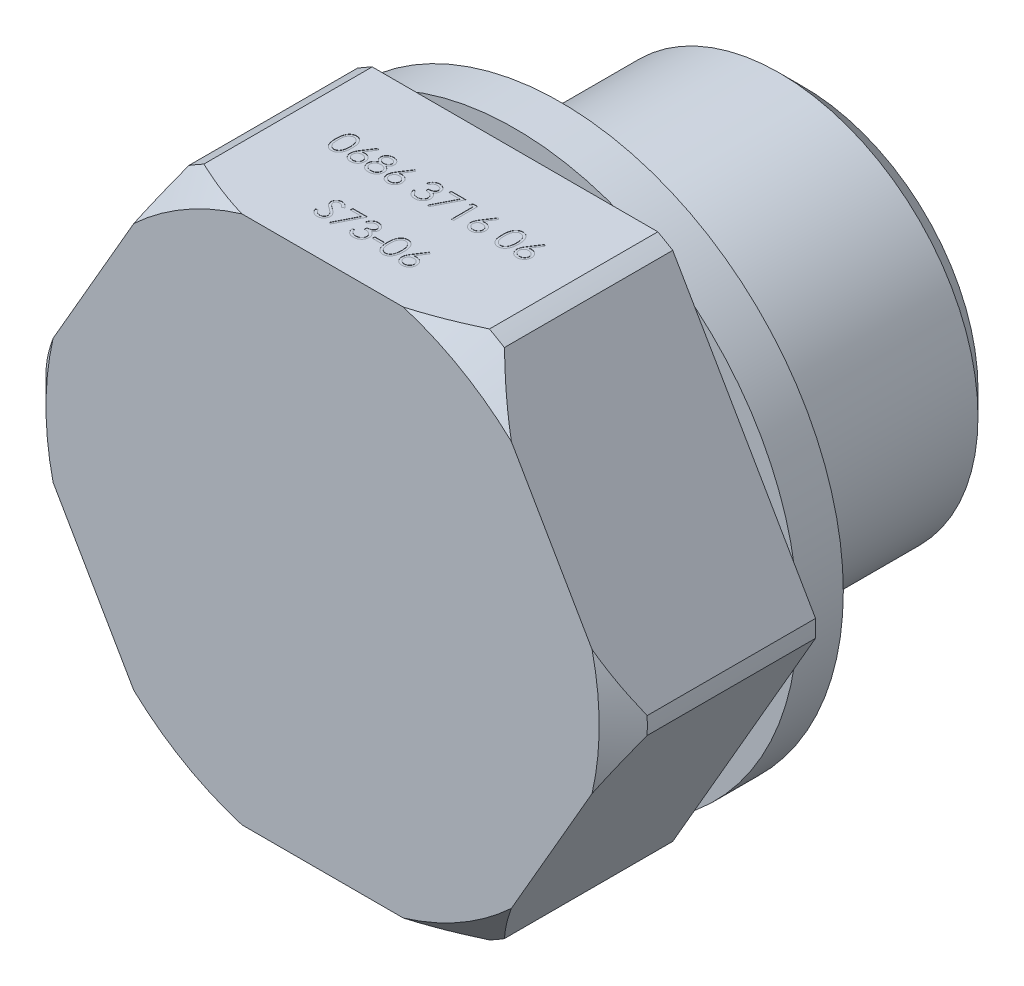
from build123d import *

# Parameters (mm, degrees)
SKETCH2_OUTSIDE_W  = 35.124
SKETCH2_OUTSIDE_H  = 35.124
EXTRUDE1_DEPTH     = 10
SKETCH3_W          = 1.9
SKETCH3_H          = 2
SKETCH4_R          = 1.2
SKETCH5_W          = 0.384615385
SKETCH5_H          = 0.102564102
CUT_EXTRUDE1_DEPTH = 0.01


with BuildPart() as part:
    # Sketch1 → Revolve1 (revolve)
    with BuildSketch(Plane(origin=(0, 0, 0), x_dir=(0, 0, -1), z_dir=(1, 0, 0)), mode=Mode.PRIVATE) as revolve1_sk:
        Polygon((0, 0), (0, 11.5), (1, 12.5), (8, 12.5), (8, 7.25), (10, 7.25), (10, 8.25), (19, 8.25), (20, 7.25), (20, 6), (17.2, 4.5), (15.203872786, 4.5), (12.5, 0), align=None)
    revolve(revolve1_sk.sketch.rotate(Axis((0, 0, 0), (0, 0, -1)), 90), axis=Axis((0, 0, 0), (0, 0, -1)))

    # Sketch2 outside → Extrude1 (cut)
    with BuildSketch(Plane.XY):
        Rectangle(SKETCH2_OUTSIDE_W, SKETCH2_OUTSIDE_H)
        Polygon((-6.350852961, 11), (-12.701705922, 0), (-6.350852961, -11), (6.350852961, -11), (12.701705922, 0), (6.350852961, 11), align=None, mode=Mode.SUBTRACT)
    extrude(amount=-EXTRUDE1_DEPTH, mode=Mode.SUBTRACT)

    # Sketch5 → Cut-Extrude1 (cut)
    # profile 1 of 16: a face of its own
    with BuildSketch(Plane(origin=(0, 11, 0), x_dir=(1, 0, 0), z_dir=(0, 1, 0))):
        with BuildLine():
            add(Edge.make_bspline(
                [(-4.112738427, 4.664679238), (-4.112644708, 4.680707063), (-4.112462656, 4.711841344), (-4.110437393, 4.757208385), (-4.10707301, 4.799768467), (-4.102462332, 4.839523629), (-4.09685148, 4.876484133), (-4.089361341, 4.910551207), (-4.080843398, 4.941882523), (-4.07097127, 4.970580251), (-4.059831902, 4.997031023), (-4.047707827, 5.021723938), (-4.034117886, 5.044621633), (-4.019838768, 5.066089573), (-4.004292462, 5.085776343), (-3.987921379, 5.103959961), (-3.970086557, 5.120220175), (-3.951394269, 5.135033404), (-3.931675279, 5.148018968), (-3.91149166, 5.159456893), (-3.890704487, 5.169228284), (-3.869257006, 5.176911265), (-3.84734199, 5.183257222), (-3.824882828, 5.187596921), (-3.801842438, 5.190327466), (-3.7862906, 5.190588514), (-3.778403491, 5.190720905)],
                knots=[0, 0, 0, 0, 1.646270934, 3.197905019, 4.663502075, 6.030701355, 7.308322542, 8.50163776, 9.611534131, 10.641858119, 11.616356847, 12.558055219, 13.465016945, 14.349605745, 15.204443733, 16.039544428, 16.859896111, 17.680448484, 18.487036065, 19.28249412, 20.06191084, 20.843045899, 21.620316918, 22.403196591, 23.190181807, 24, 24, 24, 24], degree=3))
            add(Edge.make_bspline(
                [(-3.778403491, 5.190720905), (-3.770450497, 5.190581529), (-3.754634495, 5.190304354), (-3.731251531, 5.187640371), (-3.708408764, 5.18322005), (-3.686203582, 5.176956914), (-3.664453586, 5.169186721), (-3.643328898, 5.159447545), (-3.622698303, 5.148110725), (-3.602889649, 5.134789618), (-3.583685474, 5.119937539), (-3.565557484, 5.103148205), (-3.548504031, 5.084591142), (-3.532311087, 5.064464895), (-3.517438059, 5.042383442), (-3.503274221, 5.01873084), (-3.490596497, 4.99309345), (-3.478386589, 4.96589903), (-3.46784745, 4.936395128), (-3.458342809, 4.904748053), (-3.450663104, 4.870584), (-3.444266169, 4.834082216), (-3.439310484, 4.795108649), (-3.435701158, 4.753746844), (-3.433794562, 4.70996959), (-3.433435505, 4.680038776), (-3.433251248, 4.664679238)],
                knots=[0, 0, 0, 0, 0.810914788, 1.612654377, 2.396697861, 3.181598691, 3.963628158, 4.749916497, 5.551656086, 6.361998678, 7.18212741, 8.025565596, 8.878627764, 9.750805457, 10.657531673, 11.591944965, 12.560506719, 13.57287815, 14.630710178, 15.753379473, 16.941251878, 18.199788006, 19.531962791, 20.947069417, 22.433333509, 24, 24, 24, 24], degree=3))
            add(Edge.make_bspline(
                [(-3.433251248, 4.664679238), (-3.433437415, 4.649386693), (-3.433800154, 4.619589792), (-3.435679784, 4.576009514), (-3.43938225, 4.534867216), (-3.444013675, 4.496064226), (-3.450428236, 4.459762049), (-3.458315427, 4.425835064), (-3.467072662, 4.394136758), (-3.477882603, 4.364926812), (-3.489714234, 4.337797748), (-3.502587148, 4.312464277), (-3.516378526, 4.288702479), (-3.531403882, 4.266702552), (-3.547419143, 4.24630865), (-3.564767083, 4.227880757), (-3.582958678, 4.210974851), (-3.602219369, 4.195931529), (-3.622336955, 4.182764442), (-3.642896691, 4.170989056), (-3.664263372, 4.161494), (-3.685952787, 4.153341131), (-3.708275177, 4.147112431), (-3.731202718, 4.142805615), (-3.754618785, 4.139785087), (-3.770447804, 4.139554664), (-3.778403491, 4.139438853)],
                knots=[0, 0, 0, 0, 1.561518951, 3.042555995, 4.452378317, 5.7783523, 7.031515105, 8.214008947, 9.334062868, 10.386615937, 11.391082383, 12.354592575, 13.286541444, 14.194233754, 15.072674879, 15.931287219, 16.775624067, 17.606195743, 18.42308326, 19.229000347, 20.022332153, 20.807536673, 21.593273796, 22.3848459, 23.188221202, 24, 24, 24, 24], degree=3))
            add(Edge.make_bspline(
                [(-3.778403491, 4.139438853), (-3.786290381, 4.139572098), (-3.801841788, 4.13983483), (-3.824885338, 4.142553039), (-3.847251751, 4.146923182), (-3.869051395, 4.153042212), (-3.890396113, 4.160532165), (-3.910995052, 4.170290361), (-3.931077248, 4.181528666), (-3.950589121, 4.194327358), (-3.969164024, 4.208990696), (-3.986906483, 4.225209064), (-4.003370774, 4.243387182), (-4.018694801, 4.263238017), (-4.033258826, 4.284578943), (-4.04665579, 4.307701336), (-4.059047463, 4.33251351), (-4.070374174, 4.35917577), (-4.08041665, 4.388077178), (-4.089287423, 4.419548372), (-4.096291468, 4.453867125), (-4.102286598, 4.490757802), (-4.107122136, 4.530378924), (-4.110423372, 4.572752004), (-4.112463748, 4.617850635), (-4.112645197, 4.648784856), (-4.112738427, 4.664679238)],
                knots=[0, 0, 0, 0, 0.810891512, 1.598919785, 2.382837074, 3.152667961, 3.926044502, 4.706494248, 5.493654104, 6.291793342, 7.103789334, 7.925228297, 8.761435821, 9.622817696, 10.50288917, 11.416980706, 12.369136599, 13.353924996, 14.394355917, 15.514179734, 16.714354668, 17.994756427, 19.357759367, 20.818452758, 22.365282078, 24, 24, 24, 24], degree=3))
        make_face()
        with BuildLine():
            add(Edge.make_bspline(
                [(-4.022994837, 4.665079879), (-4.02296071, 4.651723108), (-4.022894474, 4.625800238), (-4.021164131, 4.588130735), (-4.018806922, 4.552996355), (-4.015766552, 4.520352488), (-4.011251424, 4.490309627), (-4.006192341, 4.462661146), (-4.000035744, 4.437553364), (-3.992751453, 4.414813989), (-3.984454569, 4.394057113), (-3.97539575, 4.37474248), (-3.965664115, 4.356641927), (-3.954772929, 4.339918038), (-3.942911483, 4.324516277), (-3.930347694, 4.310164039), (-3.91661267, 4.297364902), (-3.897611601, 4.282014372), (-3.872526894, 4.266151762), (-3.84092105, 4.252338594), (-3.808444349, 4.243657892), (-3.786401135, 4.242553962), (-3.775398684, 4.242002956)],
                knots=[0, 0, 0, 0, 1.459021318, 2.831673884, 4.118529203, 5.306027144, 6.411944654, 7.436330062, 8.375795394, 9.233974572, 10.042671642, 10.816086306, 11.563610507, 12.285937304, 12.993564865, 13.685989202, 14.367179055, 15.041617293, 16.353048772, 17.594441528, 18.799311195, 20, 20, 20, 20], degree=3))
            add(Edge.make_bspline(
                [(-3.775398684, 4.242002956), (-3.764325063, 4.242459465), (-3.742200685, 4.24337154), (-3.709876744, 4.252171179), (-3.678496666, 4.26544819), (-3.653904683, 4.281147478), (-3.635195385, 4.296098429), (-3.621790531, 4.308845471), (-3.609487089, 4.323118576), (-3.597817924, 4.338518375), (-3.587115331, 4.355339085), (-3.577383006, 4.373499821), (-3.56850205, 4.393051014), (-3.563442322, 4.406699511), (-3.560855414, 4.413677635)],
                knots=[0, 0, 0, 0, 1.353760809, 2.704726607, 4.075137775, 5.516104923, 6.260822281, 7.007110065, 7.778089737, 8.566572457, 9.372053459, 10.217411131, 11.088608312, 12, 12, 12, 12], degree=3))
            add(Edge.make_bspline(
                [(-3.560855414, 4.413677635), (-3.557840624, 4.422600418), (-3.551719305, 4.440717494), (-3.543830227, 4.468821394), (-3.537617256, 4.498307898), (-3.532027723, 4.529000789), (-3.528212564, 4.561126417), (-3.52514176, 4.594585384), (-3.523332992, 4.629402916), (-3.523108778, 4.653058628), (-3.522994837, 4.665079879)],
                knots=[0, 0, 0, 0, 0.884706709, 1.796334032, 2.740027952, 3.714592787, 4.726048262, 5.777819803, 6.87074269, 8, 8, 8, 8], degree=3))
            add(Edge.make_bspline(
                [(-3.522994837, 4.665079879), (-3.523152034, 4.677099185), (-3.523459545, 4.700611518), (-3.52463497, 4.735045284), (-3.527670277, 4.767750359), (-3.531041454, 4.798867637), (-3.536012089, 4.828224866), (-3.541371462, 4.85606781), (-3.548571808, 4.882051532), (-3.556263173, 4.906582841), (-3.565066143, 4.929383028), (-3.574756353, 4.950558395), (-3.585105427, 4.970211174), (-3.596346067, 4.988287443), (-3.608344833, 5.004868169), (-3.621418419, 5.019620911), (-3.63504824, 5.033002901), (-3.654138864, 5.048277921), (-3.679131518, 5.063852691), (-3.710230275, 5.078185766), (-3.742593316, 5.086416706), (-3.764471446, 5.087577188), (-3.775398684, 5.088156802)],
                knots=[0, 0, 0, 0, 1.31362396, 2.569729283, 3.763502607, 4.902122613, 5.988968491, 7.01645872, 7.998833611, 8.933434873, 9.825090667, 10.667526885, 11.477055099, 12.250526234, 12.991942729, 13.710640831, 14.402115721, 15.076753259, 16.378508321, 17.609869233, 18.806226677, 20, 20, 20, 20], degree=3))
            add(Edge.make_bspline(
                [(-3.775398684, 5.088156802), (-3.786458853, 5.087576389), (-3.80859934, 5.086414505), (-3.841298756, 5.078216432), (-3.872642856, 5.063927013), (-3.89756942, 5.048226336), (-3.916673359, 5.033272532), (-3.930125557, 5.020304974), (-3.94273875, 5.00612033), (-3.954358092, 4.990576926), (-3.965240745, 4.973872535), (-3.97523532, 4.955875745), (-3.984240271, 4.936495355), (-3.992550139, 4.915747802), (-3.999856649, 4.89301039), (-4.005883496, 4.867933534), (-4.011451226, 4.840372994), (-4.015392731, 4.81016742), (-4.018896661, 4.777515376), (-4.021148475, 4.742293285), (-4.022900263, 4.704560605), (-4.022962681, 4.678503703), (-4.022994837, 4.665079879)],
                knots=[0, 0, 0, 0, 1.207732386, 2.417664972, 3.655092373, 4.956220595, 5.625982001, 6.301752483, 6.994047911, 7.697131622, 8.419323945, 9.170223765, 9.943494443, 10.752040957, 11.610060368, 12.549350801, 13.567764191, 14.679664412, 15.874934091, 17.154273443, 18.533957287, 20, 20, 20, 20], degree=3))
        make_face(mode=Mode.SUBTRACT)
    # profile 2 of 16: a face of its own
    with BuildSketch(Plane(origin=(0, 11, 0), x_dir=(1, 0, 0), z_dir=(0, 1, 0))):
        with BuildLine():
            Line((-2.881969196, 5.190720905), (-2.812658299, 5.136434046))
            Line((-2.812658299, 5.136434046), (-3.076881055, 4.732387571))
            add(Edge.make_bspline(
                [(-3.076881055, 4.732387571), (-3.059289548, 4.735191531), (-3.024975323, 4.740660973), (-2.990242209, 4.741563243), (-2.97331535, 4.742002956)],
                knots=[0, 0, 0, 0, 1.025318673, 2, 2, 2, 2], degree=3))
            add(Edge.make_bspline(
                [(-2.97331535, 4.742002956), (-2.963151268, 4.741733738), (-2.943209752, 4.741205542), (-2.913908485, 4.737031377), (-2.885746373, 4.730534311), (-2.85878624, 4.72102546), (-2.832993872, 4.708882594), (-2.808221783, 4.694328451), (-2.784935488, 4.676612592), (-2.762835153, 4.656822591), (-2.742770267, 4.634903456), (-2.72500568, 4.61164593), (-2.71008374, 4.58707425), (-2.697976905, 4.56120086), (-2.688575511, 4.534065643), (-2.681721898, 4.505703317), (-2.677670586, 4.476094325), (-2.677120446, 4.455957704), (-2.676840991, 4.445728917)],
                knots=[0, 0, 0, 0, 1.044136307, 2.048553127, 3.035567123, 4.010001674, 4.980053131, 5.96154148, 6.956538004, 7.981742224, 9.006487041, 10.005615874, 10.984750588, 11.954802044, 12.935714515, 13.930994945, 14.949008866, 16, 16, 16, 16], degree=3))
            add(Edge.make_bspline(
                [(-2.676840991, 4.445728917), (-2.677247593, 4.431734716), (-2.678047688, 4.40419744), (-2.686020201, 4.36408981), (-2.698408671, 4.32588052), (-2.716116536, 4.290179614), (-2.738111503, 4.257036022), (-2.764933672, 4.227668746), (-2.795631812, 4.201477307), (-2.830342326, 4.179575416), (-2.867697458, 4.16168883), (-2.906940886, 4.148841618), (-2.947691499, 4.140932055), (-2.975349959, 4.139940455), (-2.989340991, 4.139438853)],
                knots=[0, 0, 0, 0, 1.031375318, 2.029502543, 3.004789286, 3.987476834, 4.960371455, 5.9300674, 6.912260825, 7.929083631, 8.949397511, 9.960523116, 10.96833055, 12, 12, 12, 12], degree=3))
            add(Edge.make_bspline(
                [(-2.989340991, 4.139438853), (-3.002797191, 4.139875484), (-3.029451568, 4.140740372), (-3.068660938, 4.148444925), (-3.106336086, 4.160932669), (-3.142213052, 4.178136748), (-3.175447512, 4.199867572), (-3.205180551, 4.226028223), (-3.231263916, 4.256059499), (-3.25297095, 4.289956741), (-3.270187731, 4.326382443), (-3.283099138, 4.364364488), (-3.290640922, 4.403764483), (-3.291694795, 4.43047338), (-3.292225607, 4.443926033)],
                knots=[0, 0, 0, 0, 1.012016664, 2.004627821, 2.994792927, 3.992885782, 4.990978636, 5.973936114, 6.964471063, 7.975201453, 8.993600317, 9.990122807, 10.98767138, 12, 12, 12, 12], degree=3))
            add(Edge.make_bspline(
                [(-3.292225607, 4.443926033), (-3.291888051, 4.454224485), (-3.291198827, 4.475251957), (-3.286386429, 4.507098822), (-3.278653631, 4.539684846), (-3.269993561, 4.567328901), (-3.260843386, 4.58997505), (-3.253228375, 4.60823319), (-3.24375009, 4.627022068), (-3.23364341, 4.646985964), (-3.22199859, 4.667610374), (-3.209336976, 4.689239993), (-3.195308505, 4.71153083), (-3.185474172, 4.726657743), (-3.180446761, 4.734390776)],
                knots=[0, 0, 0, 0, 1.173818275, 2.396712641, 3.66331629, 4.989737886, 5.693666774, 6.447286557, 7.243889047, 8.091586357, 8.998013824, 9.943181721, 10.948533338, 12, 12, 12, 12], degree=3))
            Line((-3.180446761, 4.734390776), (-2.881969196, 5.190720905))
        make_face()
        with BuildLine():
            add(Edge.make_bspline(
                [(-2.992145478, 4.639438853), (-2.999763019, 4.639213605), (-3.014708571, 4.63877167), (-3.036608274, 4.636275748), (-3.057278663, 4.631546262), (-3.076957195, 4.625429827), (-3.095433828, 4.617097217), (-3.112937612, 4.607112382), (-3.129267089, 4.595149675), (-3.144342546, 4.581645128), (-3.158003753, 4.5668459), (-3.169770195, 4.550998154), (-3.179919347, 4.534479632), (-3.188171323, 4.51715341), (-3.194597051, 4.499025826), (-3.199245125, 4.480180329), (-3.201831911, 4.460490527), (-3.202262263, 4.447138383), (-3.202482017, 4.440320264)],
                knots=[0, 0, 0, 0, 1.128956033, 2.215002439, 3.259141796, 4.2666399, 5.263148119, 6.255916712, 7.247353359, 8.256307737, 9.250603402, 10.226115518, 11.176314381, 12.118911324, 13.063945463, 14.021379252, 14.989639887, 16, 16, 16, 16], degree=3))
            add(Edge.make_bspline(
                [(-3.202482017, 4.440320264), (-3.202303056, 4.433563126), (-3.201952142, 4.420313387), (-3.198765765, 4.400787907), (-3.193898598, 4.381997933), (-3.186658485, 4.364040333), (-3.178022231, 4.346641385), (-3.16662071, 4.330431304), (-3.153987343, 4.314425569), (-3.138886219, 4.29985372), (-3.122679544, 4.286294685), (-3.105364915, 4.274443184), (-3.087319212, 4.264304277), (-3.068298805, 4.256358249), (-3.048573553, 4.249837024), (-3.027979109, 4.24524803), (-3.00650115, 4.242653594), (-2.991952025, 4.242222682), (-2.984533299, 4.242002956)],
                knots=[0, 0, 0, 0, 0.989467248, 1.94019797, 2.891935182, 3.827694429, 4.772920941, 5.730924762, 6.725747692, 7.756678648, 8.79901574, 9.819492441, 10.826891316, 11.826466727, 12.835195252, 13.867842842, 14.912794438, 16, 16, 16, 16], degree=3))
            add(Edge.make_bspline(
                [(-2.984533299, 4.242002956), (-2.977114585, 4.242222699), (-2.962565484, 4.242653645), (-2.941087352, 4.245247836), (-2.920493547, 4.249837736), (-2.900765973, 4.25635567), (-2.881754136, 4.264313844), (-2.863724215, 4.274380107), (-2.846573331, 4.286367569), (-2.830356017, 4.299830549), (-2.815317749, 4.314508507), (-2.802381384, 4.330288427), (-2.791329031, 4.346772397), (-2.782347835, 4.363971794), (-2.775187466, 4.382008791), (-2.770295618, 4.400784998), (-2.767115821, 4.420314148), (-2.766764003, 4.433563384), (-2.766584581, 4.440320264)],
                knots=[0, 0, 0, 0, 1.087397944, 2.132534446, 3.165364764, 4.174271784, 5.174024072, 6.181601208, 7.194203697, 8.236725232, 9.267838612, 10.269026844, 11.221737037, 12.171628256, 13.107553087, 14.05945871, 15.010357665, 16, 16, 16, 16], degree=3))
            add(Edge.make_bspline(
                [(-2.766584581, 4.440320264), (-2.766741808, 4.447147278), (-2.767050393, 4.460546486), (-2.770540661, 4.480171525), (-2.77538135, 4.499121567), (-2.782690748, 4.517277614), (-2.792187053, 4.534567644), (-2.803753162, 4.551080436), (-2.817136166, 4.566936983), (-2.83258376, 4.58168306), (-2.849399648, 4.595066413), (-2.867165684, 4.607157292), (-2.885992439, 4.617004274), (-2.905540227, 4.625458169), (-2.926044497, 4.631449309), (-2.947281283, 4.636290514), (-2.969451817, 4.638750805), (-2.984528616, 4.639207918), (-2.992145478, 4.639438853)],
                knots=[0, 0, 0, 0, 0.978753431, 1.920974676, 2.853199117, 3.782215702, 4.721507756, 5.67862441, 6.671401678, 7.694929396, 8.738190014, 9.75360867, 10.774035531, 11.783329636, 12.805060902, 13.835252836, 14.906360638, 16, 16, 16, 16], degree=3))
        make_face(mode=Mode.SUBTRACT)
    # profile 3 of 16: a face of its own
    with BuildSketch(Plane(origin=(0, 11, 0), x_dir=(1, 0, 0), z_dir=(0, 1, 0))):
        with BuildLine():
            add(Edge.make_bspline(
                [(-2.088099004, 4.722171225), (-2.079913705, 4.717903238), (-2.063949638, 4.709579237), (-2.041213293, 4.696176143), (-2.020434721, 4.682050153), (-2.001037418, 4.667868479), (-1.983362174, 4.653088007), (-1.967606628, 4.637649963), (-1.953381594, 4.621939693), (-1.940973941, 4.605691167), (-1.930060559, 4.588947553), (-1.920628521, 4.571664903), (-1.912566463, 4.553881094), (-1.906177052, 4.535401999), (-1.900913682, 4.516499068), (-1.897292081, 4.496928216), (-1.89534439, 4.476818404), (-1.894976158, 4.463227461), (-1.894789709, 4.456345905)],
                knots=[0, 0, 0, 0, 1.272397273, 2.481599622, 3.635517121, 4.734568067, 5.792894095, 6.808321871, 7.773003508, 8.711915296, 9.623354172, 10.525449501, 11.423591555, 12.311487226, 13.218079475, 14.126165749, 15.051214107, 16, 16, 16, 16], degree=3))
            add(Edge.make_bspline(
                [(-1.894789709, 4.456345905), (-1.895010115, 4.446717981), (-1.895446381, 4.427660708), (-1.899246376, 4.399533247), (-1.904935799, 4.372215595), (-1.913244231, 4.345713741), (-1.924019485, 4.32017392), (-1.937298581, 4.29557427), (-1.952330354, 4.27151161), (-1.964402423, 4.256706067), (-1.970510863, 4.249214494)],
                knots=[0, 0, 0, 0, 1.025265484, 2.029385089, 3.018602448, 3.995076438, 4.983346944, 5.966715145, 6.97116228, 8, 8, 8, 8], degree=3))
            add(Edge.make_bspline(
                [(-1.970510863, 4.249214494), (-1.978464141, 4.240473416), (-1.994272417, 4.223099275), (-2.021353254, 4.200541901), (-2.051073792, 4.181584931), (-2.08331903, 4.166135818), (-2.118002773, 4.154111287), (-2.155117632, 4.145470568), (-2.194735961, 4.140521302), (-2.221966096, 4.139805877), (-2.235935543, 4.139438853)],
                knots=[0, 0, 0, 0, 0.954267603, 1.896743057, 2.838368354, 3.796610408, 4.779680527, 5.799409237, 6.871065594, 8, 8, 8, 8], degree=3))
            add(Edge.make_bspline(
                [(-2.235935543, 4.139438853), (-2.249367939, 4.139768133), (-2.275506019, 4.140408877), (-2.313551127, 4.144750143), (-2.349014861, 4.152358105), (-2.382103424, 4.162770851), (-2.412617336, 4.17631663), (-2.440469651, 4.193176175), (-2.466062214, 4.212670873), (-2.488618349, 4.23536061), (-2.508643619, 4.259662859), (-2.526234491, 4.284734748), (-2.540855657, 4.310578564), (-2.553234827, 4.336808955), (-2.562711405, 4.36379357), (-2.569274893, 4.391393574), (-2.573443269, 4.419560758), (-2.573997879, 4.438569801), (-2.574276889, 4.448132764)],
                knots=[0, 0, 0, 0, 1.256902934, 2.445805442, 3.576955095, 4.645999104, 5.686449165, 6.692658513, 7.68621702, 8.689161843, 9.678783111, 10.630372946, 11.551080876, 12.453998257, 13.34127905, 14.221779781, 15.105423033, 16, 16, 16, 16], degree=3))
            add(Edge.make_bspline(
                [(-2.574276889, 4.448132764), (-2.57411178, 4.455149676), (-2.573785466, 4.46901757), (-2.571526938, 4.48950595), (-2.567895949, 4.509447703), (-2.562964676, 4.528916487), (-2.556281526, 4.547770564), (-2.548212345, 4.566099271), (-2.538803215, 4.583923299), (-2.527922883, 4.601340123), (-2.515265161, 4.618105698), (-2.50093269, 4.634504553), (-2.484639013, 4.65028223), (-2.466565397, 4.665631494), (-2.446918385, 4.680824629), (-2.425187662, 4.695040552), (-2.4019493, 4.709285684), (-2.38543347, 4.717802349), (-2.376961184, 4.722171225)],
                knots=[0, 0, 0, 0, 0.941657376, 1.861047343, 2.762797495, 3.66048619, 4.553285746, 5.444104102, 6.34607688, 7.256116206, 8.197091036, 9.162375105, 10.176350973, 11.237807142, 12.343728897, 13.50695164, 14.721116704, 16, 16, 16, 16], degree=3))
            add(Edge.make_bspline(
                [(-2.376961184, 4.722171225), (-2.388558719, 4.728495445), (-2.411014794, 4.740740904), (-2.44074892, 4.763239991), (-2.466289098, 4.787607939), (-2.486933304, 4.814359308), (-2.503182512, 4.842658415), (-2.514330684, 4.872328202), (-2.521872537, 4.90281852), (-2.52261963, 4.923648862), (-2.522994837, 4.934110328)],
                knots=[0, 0, 0, 0, 1.166880483, 2.259407225, 3.286803203, 4.280235371, 5.237608625, 6.161067461, 7.076446754, 8, 8, 8, 8], degree=3))
            add(Edge.make_bspline(
                [(-2.522994837, 4.934110328), (-2.522527573, 4.944766773), (-2.521588291, 4.966188086), (-2.513993057, 4.99807555), (-2.501615895, 5.029394569), (-2.484781324, 5.059993344), (-2.463813548, 5.088836262), (-2.438657392, 5.114705104), (-2.409913593, 5.137365528), (-2.377725631, 5.156387291), (-2.343086707, 5.171868337), (-2.306539357, 5.182547886), (-2.268720359, 5.189529634), (-2.242978153, 5.190320106), (-2.229925927, 5.190720905)],
                knots=[0, 0, 0, 0, 0.888701115, 1.786444228, 2.72001202, 3.692817113, 4.693886446, 5.687152267, 6.695133018, 7.739871481, 8.800368666, 9.853104506, 10.91144658, 12, 12, 12, 12], degree=3))
            add(Edge.make_bspline(
                [(-2.229925927, 5.190720905), (-2.217210551, 5.190307664), (-2.192137279, 5.1894928), (-2.155281671, 5.182696549), (-2.120017421, 5.171345257), (-2.086466135, 5.155946051), (-2.055228459, 5.136978353), (-2.027627799, 5.114006675), (-2.003247061, 5.088251946), (-1.983080091, 5.059417774), (-1.966462123, 5.028936576), (-1.954890437, 4.997044427), (-1.947475587, 4.96443041), (-1.94654034, 4.942362409), (-1.946071761, 4.93130584)],
                knots=[0, 0, 0, 0, 1.072916533, 2.115669174, 3.151510826, 4.193348718, 5.225979165, 6.227137561, 7.216255879, 8.211077061, 9.189680878, 10.138522389, 11.067357538, 12, 12, 12, 12], degree=3))
            add(Edge.make_bspline(
                [(-1.946071761, 4.93130584), (-1.946481635, 4.920455365), (-1.947286605, 4.899145648), (-1.954058016, 4.868080928), (-1.96546182, 4.838988917), (-1.981031581, 4.811539502), (-2.001324578, 4.786230503), (-2.02606993, 4.762740083), (-2.055070352, 4.740875275), (-2.076859177, 4.728536313), (-2.088099004, 4.722171225)],
                knots=[0, 0, 0, 0, 0.975232327, 1.915300861, 2.843280834, 3.77672583, 4.742871857, 5.749627742, 6.839139064, 8, 8, 8, 8], degree=3))
        make_face()
        with BuildLine():
            add(Edge.make_bspline(
                [(-2.23493394, 5.088156802), (-2.241948456, 5.087970676), (-2.255671916, 5.087606533), (-2.275794394, 5.085704065), (-2.294929356, 5.082003146), (-2.313276727, 5.0770778), (-2.33058496, 5.070424089), (-2.347089118, 5.062596943), (-2.362508315, 5.053080924), (-2.377028687, 5.042406297), (-2.390100337, 5.030665466), (-2.401701638, 5.018432975), (-2.411338242, 5.005468577), (-2.419521416, 4.99209476), (-2.425458992, 4.977914596), (-2.429905936, 4.963362831), (-2.432912048, 4.948255578), (-2.433137302, 4.937930861), (-2.433251248, 4.932708084)],
                knots=[0, 0, 0, 0, 1.203892937, 2.355340988, 3.463153438, 4.544400666, 5.610487187, 6.640501085, 7.674077295, 8.714426146, 9.728707835, 10.68524104, 11.601827946, 12.495867327, 13.368432065, 14.231010473, 15.105153427, 16, 16, 16, 16], degree=3))
            add(Edge.make_bspline(
                [(-2.433251248, 4.932708084), (-2.433054857, 4.927485081), (-2.432666761, 4.917163678), (-2.429665296, 4.901922002), (-2.425191909, 4.886944391), (-2.418148863, 4.872586988), (-2.409701332, 4.858351743), (-2.399275196, 4.844594432), (-2.386849759, 4.831267179), (-2.372841919, 4.818483339), (-2.35758148, 4.806512264), (-2.34141461, 4.796119926), (-2.324544213, 4.787424466), (-2.307143622, 4.780187493), (-2.289035494, 4.774561797), (-2.270330787, 4.770570755), (-2.251026358, 4.768090185), (-2.237946192, 4.767793893), (-2.231328171, 4.767643981)],
                knots=[0, 0, 0, 0, 0.873023192, 1.725219244, 2.590779336, 3.480155217, 4.391973325, 5.357036234, 6.360879153, 7.436073238, 8.526419356, 9.601555421, 10.645666583, 11.697338044, 12.750135903, 13.812665442, 14.89329948, 16, 16, 16, 16], degree=3))
            add(Edge.make_bspline(
                [(-2.231328171, 4.767643981), (-2.222828141, 4.767893372), (-2.205912036, 4.76838969), (-2.180975084, 4.773004311), (-2.156728614, 4.780263145), (-2.133431785, 4.790194564), (-2.111687617, 4.802659667), (-2.092304741, 4.817583386), (-2.075448486, 4.834621128), (-2.061294026, 4.853507653), (-2.050319784, 4.873608106), (-2.04177641, 4.893779619), (-2.036787491, 4.914237399), (-2.036136758, 4.927942246), (-2.03581535, 4.934711289)],
                knots=[0, 0, 0, 0, 1.076279235, 2.141928126, 3.20205304, 4.278698113, 5.344010996, 6.36967002, 7.368914609, 8.37248503, 9.349703398, 10.264243087, 11.142681841, 12, 12, 12, 12], degree=3))
            add(Edge.make_bspline(
                [(-2.03581535, 4.934711289), (-2.035967321, 4.939462157), (-2.036268961, 4.948891947), (-2.038754691, 4.962817195), (-2.042862072, 4.976425647), (-2.048422952, 4.989829724), (-2.055740036, 5.002841362), (-2.064415519, 5.015665102), (-2.074953948, 5.028012463), (-2.0867815, 5.040171191), (-2.100194474, 5.051423769), (-2.11516702, 5.061319401), (-2.131622378, 5.069722931), (-2.149560935, 5.076548289), (-2.168916627, 5.081674675), (-2.189600306, 5.085513632), (-2.211784433, 5.087677378), (-2.227050077, 5.087993528), (-2.23493394, 5.088156802)],
                knots=[0, 0, 0, 0, 0.814439003, 1.616544685, 2.417341072, 3.248991801, 4.09997495, 4.973547432, 5.9003056, 6.880240646, 7.880314356, 8.896779544, 9.951930927, 11.043077905, 12.18215768, 13.381699519, 14.647792085, 16, 16, 16, 16], degree=3))
        make_face(mode=Mode.SUBTRACT)
        with BuildLine():
            add(Edge.make_bspline(
                [(-2.229124645, 4.665079879), (-2.238017727, 4.664921696), (-2.255463783, 4.664611379), (-2.281022905, 4.661157236), (-2.305552381, 4.656348838), (-2.328969506, 4.649054312), (-2.351264391, 4.639569601), (-2.372557728, 4.628159732), (-2.392686623, 4.614672463), (-2.411373116, 4.599279144), (-2.428436924, 4.582690729), (-2.443407867, 4.565130119), (-2.456121444, 4.546923681), (-2.466359516, 4.527840187), (-2.474762868, 4.508283726), (-2.480281119, 4.487767271), (-2.483818751, 4.466685238), (-2.484293788, 4.452353782), (-2.484533299, 4.445127956)],
                knots=[0, 0, 0, 0, 1.140299081, 2.23698856, 3.303958914, 4.344563908, 5.37730929, 6.408454204, 7.439741482, 8.480804886, 9.510774543, 10.48932336, 11.43758569, 12.353841022, 13.263987381, 14.161954604, 15.073269652, 16, 16, 16, 16], degree=3))
            add(Edge.make_bspline(
                [(-2.484533299, 4.445127956), (-2.484143796, 4.436147697), (-2.483371033, 4.418331073), (-2.477240564, 4.391998767), (-2.46740184, 4.366507037), (-2.45368035, 4.342063622), (-2.436689615, 4.319220735), (-2.415796338, 4.299309656), (-2.392298956, 4.281617805), (-2.365402426, 4.267309081), (-2.336022864, 4.255881979), (-2.304168085, 4.248008847), (-2.270295251, 4.242797004), (-2.246906796, 4.24227181), (-2.23493394, 4.242002956)],
                knots=[0, 0, 0, 0, 0.898778495, 1.783155532, 2.693654817, 3.627872908, 4.583023416, 5.533784346, 6.509005473, 7.520592997, 8.575161974, 9.658835044, 10.801527049, 12, 12, 12, 12], degree=3))
            add(Edge.make_bspline(
                [(-2.23493394, 4.242002956), (-2.225576692, 4.242182615), (-2.207345772, 4.24253265), (-2.180749787, 4.245622448), (-2.155651344, 4.250522341), (-2.132099116, 4.257649068), (-2.109829448, 4.266349062), (-2.089219918, 4.277541085), (-2.069740339, 4.29027032), (-2.05235059, 4.305372651), (-2.03651253, 4.321509649), (-2.022703018, 4.338592518), (-2.010715146, 4.356156985), (-2.001306302, 4.37459998), (-1.993784515, 4.39356767), (-1.988377785, 4.413234959), (-1.985041723, 4.433662169), (-1.984704325, 4.447519046), (-1.984533299, 4.45454302)],
                knots=[0, 0, 0, 0, 1.224942928, 2.386581632, 3.501229538, 4.569074225, 5.605009692, 6.626002462, 7.634866581, 8.645888296, 9.63523824, 10.59253846, 11.518950513, 12.414518923, 13.29783783, 14.186679152, 15.080837789, 16, 16, 16, 16], degree=3))
            add(Edge.make_bspline(
                [(-1.984533299, 4.45454302), (-1.984792113, 4.461365117), (-1.985302449, 4.474817101), (-1.988541503, 4.494750395), (-1.994231754, 4.514008342), (-2.002039582, 4.532822629), (-2.012434142, 4.550812044), (-2.024675534, 4.568445235), (-2.039445282, 4.585232791), (-2.056134595, 4.601305104), (-2.07432287, 4.616166743), (-2.09365634, 4.629313726), (-2.113986186, 4.640385759), (-2.135269389, 4.649390472), (-2.157458691, 4.656472606), (-2.18053777, 4.661420033), (-2.204533649, 4.664534205), (-2.22083504, 4.664895933), (-2.229124645, 4.665079879)],
                knots=[0, 0, 0, 0, 0.917430815, 1.809013306, 2.70690318, 3.612392954, 4.541220862, 5.495268465, 6.494511384, 7.542276156, 8.608045339, 9.649016899, 10.681629292, 11.715607085, 12.752076957, 13.808767841, 14.885711793, 16, 16, 16, 16], degree=3))
        make_face(mode=Mode.SUBTRACT)
    # profile 4 of 16: a face of its own
    with BuildSketch(Plane(origin=(0, 11, 0), x_dir=(1, 0, 0), z_dir=(0, 1, 0))):
        with BuildLine():
            Line((-1.343507658, 5.190720905), (-1.274196761, 5.136434046))
            Line((-1.274196761, 5.136434046), (-1.538419517, 4.732387571))
            add(Edge.make_bspline(
                [(-1.538419517, 4.732387571), (-1.520828009, 4.735191531), (-1.486513784, 4.740660973), (-1.451780671, 4.741563243), (-1.434853812, 4.742002956)],
                knots=[0, 0, 0, 0, 1.025318673, 2, 2, 2, 2], degree=3))
            add(Edge.make_bspline(
                [(-1.434853812, 4.742002956), (-1.42468973, 4.741733738), (-1.404748213, 4.741205542), (-1.375446946, 4.737031377), (-1.347284834, 4.730534311), (-1.320324702, 4.72102546), (-1.294532334, 4.708882594), (-1.269760244, 4.694328451), (-1.246473949, 4.676612592), (-1.224373614, 4.656822591), (-1.204308729, 4.634903456), (-1.186544142, 4.61164593), (-1.171622201, 4.58707425), (-1.159515366, 4.56120086), (-1.150113972, 4.534065643), (-1.14326036, 4.505703317), (-1.139209047, 4.476094325), (-1.138658907, 4.455957704), (-1.138379453, 4.445728917)],
                knots=[0, 0, 0, 0, 1.044136307, 2.048553127, 3.035567123, 4.010001674, 4.980053131, 5.96154148, 6.956538004, 7.981742224, 9.006487041, 10.005615874, 10.984750588, 11.954802044, 12.935714515, 13.930994945, 14.949008866, 16, 16, 16, 16], degree=3))
            add(Edge.make_bspline(
                [(-1.138379453, 4.445728917), (-1.138786054, 4.431734716), (-1.13958615, 4.40419744), (-1.147558663, 4.36408981), (-1.159947133, 4.32588052), (-1.177654998, 4.290179614), (-1.199649964, 4.257036022), (-1.226472134, 4.227668746), (-1.257170273, 4.201477307), (-1.291880787, 4.179575416), (-1.32923592, 4.16168883), (-1.368479348, 4.148841618), (-1.409229961, 4.140932055), (-1.43688842, 4.139940455), (-1.450879453, 4.139438853)],
                knots=[0, 0, 0, 0, 1.031375318, 2.029502543, 3.004789286, 3.987476834, 4.960371455, 5.9300674, 6.912260825, 7.929083631, 8.949397511, 9.960523116, 10.96833055, 12, 12, 12, 12], degree=3))
            add(Edge.make_bspline(
                [(-1.450879453, 4.139438853), (-1.464335653, 4.139875484), (-1.49099003, 4.140740372), (-1.530199399, 4.148444925), (-1.567874547, 4.160932669), (-1.603751513, 4.178136748), (-1.636985974, 4.199867572), (-1.666719013, 4.226028223), (-1.692802377, 4.256059499), (-1.714509412, 4.289956741), (-1.731726192, 4.326382443), (-1.744637599, 4.364364488), (-1.752179383, 4.403764483), (-1.753233257, 4.43047338), (-1.753764068, 4.443926033)],
                knots=[0, 0, 0, 0, 1.012016664, 2.004627821, 2.994792927, 3.992885782, 4.990978636, 5.973936114, 6.964471063, 7.975201453, 8.993600317, 9.990122807, 10.98767138, 12, 12, 12, 12], degree=3))
            add(Edge.make_bspline(
                [(-1.753764068, 4.443926033), (-1.753426512, 4.454224485), (-1.752737288, 4.475251957), (-1.747924891, 4.507098822), (-1.740192092, 4.539684846), (-1.731532022, 4.567328901), (-1.722381848, 4.58997505), (-1.714766836, 4.60823319), (-1.705288552, 4.627022068), (-1.695181872, 4.646985964), (-1.683537052, 4.667610374), (-1.670875438, 4.689239993), (-1.656846966, 4.71153083), (-1.647012634, 4.726657743), (-1.641985222, 4.734390776)],
                knots=[0, 0, 0, 0, 1.173818275, 2.396712641, 3.66331629, 4.989737886, 5.693666774, 6.447286557, 7.243889047, 8.091586357, 8.998013824, 9.943181721, 10.948533338, 12, 12, 12, 12], degree=3))
            Line((-1.641985222, 4.734390776), (-1.343507658, 5.190720905))
        make_face()
        with BuildLine():
            add(Edge.make_bspline(
                [(-1.45368394, 4.639438853), (-1.461301481, 4.639213605), (-1.476247033, 4.63877167), (-1.498146735, 4.636275748), (-1.518817124, 4.631546262), (-1.538495657, 4.625429827), (-1.556972289, 4.617097217), (-1.574476073, 4.607112382), (-1.59080555, 4.595149675), (-1.605881008, 4.581645128), (-1.619542214, 4.5668459), (-1.631308656, 4.550998154), (-1.641457809, 4.534479632), (-1.649709784, 4.51715341), (-1.656135513, 4.499025826), (-1.660783587, 4.480180329), (-1.663370372, 4.460490527), (-1.663800724, 4.447138383), (-1.664020478, 4.440320264)],
                knots=[0, 0, 0, 0, 1.128956033, 2.215002439, 3.259141796, 4.2666399, 5.263148119, 6.255916712, 7.247353359, 8.256307737, 9.250603402, 10.226115518, 11.176314381, 12.118911324, 13.063945463, 14.021379252, 14.989639887, 16, 16, 16, 16], degree=3))
            add(Edge.make_bspline(
                [(-1.664020478, 4.440320264), (-1.663841518, 4.433563126), (-1.663490603, 4.420313387), (-1.660304226, 4.400787907), (-1.65543706, 4.381997933), (-1.648196947, 4.364040333), (-1.639560693, 4.346641385), (-1.628159172, 4.330431304), (-1.615525804, 4.314425569), (-1.600424681, 4.29985372), (-1.584218005, 4.286294685), (-1.566903376, 4.274443184), (-1.548857673, 4.264304277), (-1.529837267, 4.256358249), (-1.510112014, 4.249837024), (-1.48951757, 4.24524803), (-1.468039612, 4.242653594), (-1.453490487, 4.242222682), (-1.446071761, 4.242002956)],
                knots=[0, 0, 0, 0, 0.989467248, 1.94019797, 2.891935182, 3.827694429, 4.772920941, 5.730924762, 6.725747692, 7.756678648, 8.79901574, 9.819492441, 10.826891316, 11.826466727, 12.835195252, 13.867842842, 14.912794438, 16, 16, 16, 16], degree=3))
            add(Edge.make_bspline(
                [(-1.446071761, 4.242002956), (-1.438653047, 4.242222699), (-1.424103945, 4.242653645), (-1.402625814, 4.245247836), (-1.382032009, 4.249837736), (-1.362304435, 4.25635567), (-1.343292597, 4.264313844), (-1.325262677, 4.274380107), (-1.308111793, 4.286367569), (-1.291894479, 4.299830549), (-1.276856211, 4.314508507), (-1.263919845, 4.330288427), (-1.252867493, 4.346772397), (-1.243886297, 4.363971794), (-1.236725928, 4.382008791), (-1.23183408, 4.400784998), (-1.228654283, 4.420314148), (-1.228302464, 4.433563384), (-1.228123043, 4.440320264)],
                knots=[0, 0, 0, 0, 1.087397944, 2.132534446, 3.165364764, 4.174271784, 5.174024072, 6.181601208, 7.194203697, 8.236725232, 9.267838612, 10.269026844, 11.221737037, 12.171628256, 13.107553087, 14.05945871, 15.010357665, 16, 16, 16, 16], degree=3))
            add(Edge.make_bspline(
                [(-1.228123043, 4.440320264), (-1.228280269, 4.447147278), (-1.228588854, 4.460546486), (-1.232079123, 4.480171525), (-1.236919811, 4.499121567), (-1.244229209, 4.517277614), (-1.253725515, 4.534567644), (-1.265291624, 4.551080436), (-1.278674628, 4.566936983), (-1.294122222, 4.58168306), (-1.310938109, 4.595066413), (-1.328704146, 4.607157292), (-1.347530901, 4.617004274), (-1.367078689, 4.625458169), (-1.387582958, 4.631449309), (-1.408819744, 4.636290514), (-1.430990279, 4.638750805), (-1.446067078, 4.639207918), (-1.45368394, 4.639438853)],
                knots=[0, 0, 0, 0, 0.978753431, 1.920974676, 2.853199117, 3.782215702, 4.721507756, 5.67862441, 6.671401678, 7.694929396, 8.738190014, 9.75360867, 10.774035531, 11.783329636, 12.805060902, 13.835252836, 14.906360638, 16, 16, 16, 16], degree=3))
        make_face(mode=Mode.SUBTRACT)
    # profile 5 of 16: a face of its own
    with BuildSketch(Plane(origin=(0, 11, 0), x_dir=(1, 0, 0), z_dir=(0, 1, 0))):
        with BuildLine():
            Line((-0.522994837, 4.934310648), (-0.612738427, 4.934310648))
            add(Edge.make_bspline(
                [(-0.612738427, 4.934310648), (-0.610307127, 4.944377072), (-0.605554134, 4.964056108), (-0.595640542, 4.992172468), (-0.584840754, 5.018779188), (-0.571872439, 5.043378067), (-0.55772708, 5.066463467), (-0.541520589, 5.087511789), (-0.524000668, 5.10705835), (-0.504622111, 5.124404989), (-0.484299636, 5.140112912), (-0.462746888, 5.153505786), (-0.440397489, 5.165026972), (-0.417096594, 5.174518467), (-0.392774831, 5.181668617), (-0.367652081, 5.186856275), (-0.34166251, 5.190225165), (-0.324020341, 5.190553955), (-0.315062145, 5.190720905)],
                knots=[0, 0, 0, 0, 1.162005537, 2.271625781, 3.343758855, 4.383309926, 5.390229558, 6.379919256, 7.361854164, 8.333198761, 9.295911338, 10.242430842, 11.177959212, 12.116337295, 13.062827104, 14.020064771, 14.994644689, 16, 16, 16, 16], degree=3))
            add(Edge.make_bspline(
                [(-0.315062145, 5.190720905), (-0.302009933, 5.190326839), (-0.276190216, 5.189547303), (-0.238257917, 5.182428893), (-0.201678825, 5.171164569), (-0.166853326, 5.155600647), (-0.134505202, 5.136404272), (-0.105723435, 5.113557204), (-0.080898146, 5.087500261), (-0.060071181, 5.058719528), (-0.043764038, 5.027960811), (-0.03173936, 4.996303623), (-0.02441888, 4.96382306), (-0.023470149, 4.941892409), (-0.022994837, 4.930905199)],
                knots=[0, 0, 0, 0, 1.083050992, 2.142477498, 3.193116406, 4.255571735, 5.30263384, 6.308962982, 7.297363603, 8.282367274, 9.249857812, 10.179914175, 11.08814088, 12, 12, 12, 12], degree=3))
            add(Edge.make_bspline(
                [(-0.022994837, 4.930905199), (-0.023327292, 4.92033183), (-0.023977854, 4.899641385), (-0.02950177, 4.869435243), (-0.038797845, 4.840966215), (-0.05167492, 4.814114454), (-0.068343934, 4.789050214), (-0.088536134, 4.765717102), (-0.112394037, 4.744011629), (-0.130473733, 4.731577494), (-0.139781696, 4.725176033)],
                knots=[0, 0, 0, 0, 1.024540389, 2.004866551, 2.965041327, 3.920577974, 4.882998113, 5.874504559, 6.905732034, 8, 8, 8, 8], degree=3))
            add(Edge.make_bspline(
                [(-0.139781696, 4.725176033), (-0.129144052, 4.720039412), (-0.108067802, 4.709862282), (-0.07933908, 4.689903494), (-0.053259687, 4.666858823), (-0.038715767, 4.648875208), (-0.031408299, 4.639839494)],
                knots=[0, 0, 0, 0, 1.015518401, 2.012035669, 3.001164323, 4, 4, 4, 4], degree=3))
            add(Edge.make_bspline(
                [(-0.031408299, 4.639839494), (-0.026596487, 4.633251565), (-0.017051659, 4.620183589), (-0.005270078, 4.599173182), (0.00541824, 4.577929899), (0.013746874, 4.555884354), (0.02019655, 4.533292065), (0.024806845, 4.510114237), (0.027670886, 4.486331945), (0.028081043, 4.470242665), (0.028287214, 4.462155199)],
                knots=[0, 0, 0, 0, 1.025084078, 2.033381695, 3.024893161, 4.013698104, 4.991890475, 5.976764909, 6.982997093, 8, 8, 8, 8], degree=3))
            add(Edge.make_bspline(
                [(0.028287214, 4.462155199), (0.027774496, 4.448152422), (0.026751472, 4.420212764), (0.017607451, 4.378934272), (0.003432239, 4.338584129), (-0.016698314, 4.299991318), (-0.041231888, 4.263882637), (-0.070419695, 4.231575121), (-0.103930097, 4.203804091), (-0.14130314, 4.180601168), (-0.181793748, 4.162053191), (-0.22510106, 4.149179636), (-0.270601075, 4.140795064), (-0.30180316, 4.139895959), (-0.317666312, 4.139438853)],
                knots=[0, 0, 0, 0, 0.955779014, 1.907060117, 2.875433937, 3.871313158, 4.872415639, 5.851225146, 6.836215519, 7.83643374, 8.849228613, 9.86973379, 10.916971861, 12, 12, 12, 12], degree=3))
            add(Edge.make_bspline(
                [(-0.317666312, 4.139438853), (-0.32835754, 4.139686914), (-0.349394313, 4.140175015), (-0.380321027, 4.143511759), (-0.409841513, 4.149606046), (-0.437995683, 4.15780699), (-0.464808551, 4.168204631), (-0.490198295, 4.18115283), (-0.514321122, 4.196384688), (-0.536949394, 4.214079999), (-0.558080413, 4.233874667), (-0.57715262, 4.256120099), (-0.59448399, 4.280405071), (-0.609610458, 4.307011659), (-0.623221016, 4.335596018), (-0.634415575, 4.36652416), (-0.644268594, 4.399519595), (-0.648849584, 4.422513235), (-0.651199966, 4.434310648)],
                knots=[0, 0, 0, 0, 1.048658725, 2.063410685, 3.046034179, 4.001477787, 4.936774919, 5.862367409, 6.792675028, 7.730719943, 8.675894397, 9.627829632, 10.600096036, 11.597688215, 12.626045268, 13.701542398, 14.82072376, 16, 16, 16, 16], degree=3))
            Line((-0.651199966, 4.434310648), (-0.561456376, 4.434310648))
            add(Edge.make_bspline(
                [(-0.561456376, 4.434310648), (-0.559118293, 4.42661093), (-0.554570518, 4.41163431), (-0.54682929, 4.390079937), (-0.538009783, 4.370320493), (-0.528548481, 4.352211029), (-0.518611782, 4.3355732), (-0.507493232, 4.320846952), (-0.496016333, 4.307385465), (-0.487365089, 4.299801291), (-0.483131055, 4.296089494)],
                knots=[0, 0, 0, 0, 1.198163088, 2.33053128, 3.407730985, 4.417276592, 5.372219308, 6.28897303, 7.162600585, 8, 8, 8, 8], degree=3))
            add(Edge.make_bspline(
                [(-0.483131055, 4.296089494), (-0.477532034, 4.291772827), (-0.466351273, 4.283152818), (-0.448131778, 4.272152353), (-0.428970382, 4.262620632), (-0.408451904, 4.255339576), (-0.387019112, 4.24917453), (-0.364325579, 4.245140096), (-0.340571517, 4.242372047), (-0.324352156, 4.242127781), (-0.316063748, 4.242002956)],
                knots=[0, 0, 0, 0, 0.946170439, 1.889420265, 2.845303464, 3.807233317, 4.801018734, 5.828864929, 6.890507805, 8, 8, 8, 8], degree=3))
            add(Edge.make_bspline(
                [(-0.316063748, 4.242002956), (-0.306705604, 4.242178929), (-0.288406562, 4.242523029), (-0.261705174, 4.245687516), (-0.236303046, 4.250296206), (-0.21248221, 4.257414201), (-0.189930636, 4.26620873), (-0.168964451, 4.277251132), (-0.14930842, 4.290206766), (-0.131214305, 4.30493224), (-0.11494416, 4.321052667), (-0.100618584, 4.337913545), (-0.08844011, 4.355443782), (-0.07861623, 4.373740388), (-0.07085893, 4.392727596), (-0.065578016, 4.41245869), (-0.061906154, 4.432772195), (-0.061607122, 4.446580472), (-0.061456376, 4.453541417)],
                knots=[0, 0, 0, 0, 1.217147791, 2.380027433, 3.494444702, 4.572153297, 5.609568379, 6.639424714, 7.649109417, 8.668170816, 9.669597737, 10.625200337, 11.543417969, 12.441394052, 13.322311151, 14.205496177, 15.095365482, 16, 16, 16, 16], degree=3))
            add(Edge.make_bspline(
                [(-0.061456376, 4.453541417), (-0.061893605, 4.462858943), (-0.062765887, 4.481447631), (-0.069425481, 4.508795509), (-0.080379443, 4.535145056), (-0.095714446, 4.56004671), (-0.114381797, 4.583125539), (-0.136200342, 4.603717391), (-0.161351264, 4.620708846), (-0.184499798, 4.632448462), (-0.205004129, 4.640459055), (-0.222551381, 4.645794759), (-0.242196125, 4.650312946), (-0.263700796, 4.654516452), (-0.287227429, 4.65809398), (-0.312750412, 4.661077356), (-0.340274915, 4.663464511), (-0.359329534, 4.664530538), (-0.369148684, 4.665079879)],
                knots=[0, 0, 0, 0, 1.07054697, 2.135767047, 3.216561865, 4.33974944, 5.486079747, 6.621378074, 7.775625952, 8.963672916, 9.598146892, 10.304877434, 11.070270905, 11.915000392, 12.823868403, 13.805723172, 14.86925407, 16, 16, 16, 16], degree=3))
            Line((-0.369148684, 4.665079879), (-0.369148684, 4.767643981))
            add(Edge.make_bspline(
                [(-0.369148684, 4.767643981), (-0.356776922, 4.767853925), (-0.33254368, 4.768265154), (-0.297145307, 4.773238871), (-0.26329579, 4.780119051), (-0.231745292, 4.790657677), (-0.202988517, 4.802897762), (-0.178040059, 4.81714125), (-0.157249445, 4.832974036), (-0.140717711, 4.850640496), (-0.128280788, 4.869587652), (-0.119187417, 4.889335269), (-0.113815896, 4.910056429), (-0.113098848, 4.924197762), (-0.112738427, 4.93130584)],
                knots=[0, 0, 0, 0, 1.321986639, 2.589447074, 3.816329219, 5.01088745, 6.139805852, 7.153945165, 8.075214402, 8.924034688, 9.728124013, 10.488707548, 11.240355623, 12, 12, 12, 12], degree=3))
            add(Edge.make_bspline(
                [(-0.112738427, 4.93130584), (-0.11285683, 4.936528053), (-0.113092388, 4.946917398), (-0.116063039, 4.962095989), (-0.12052705, 4.976810545), (-0.126664116, 4.990998491), (-0.134878458, 5.004561426), (-0.14470874, 5.017614983), (-0.156413912, 5.030084634), (-0.169826896, 5.041707583), (-0.184230269, 5.052784508), (-0.200015919, 5.062188404), (-0.216707884, 5.07022985), (-0.234324642, 5.076861137), (-0.252923365, 5.081849505), (-0.272416667, 5.085431174), (-0.29284172, 5.087670504), (-0.3067765, 5.087992908), (-0.313860222, 5.088156802)],
                knots=[0, 0, 0, 0, 0.884392785, 1.759457502, 2.611959086, 3.489218968, 4.37281399, 5.2945488, 6.255912374, 7.266815255, 8.301784654, 9.332968512, 10.37626691, 11.440494194, 12.520033166, 13.637162961, 14.798855837, 16, 16, 16, 16], degree=3))
            add(Edge.make_bspline(
                [(-0.313860222, 5.088156802), (-0.325246413, 5.08775927), (-0.347486292, 5.086982798), (-0.379547697, 5.080181937), (-0.409353221, 5.069331056), (-0.432135697, 5.056378764), (-0.448959289, 5.043592926), (-0.460981272, 5.03242653), (-0.472787132, 5.020017152), (-0.483600182, 5.005600473), (-0.494535604, 4.990152819), (-0.504491193, 4.97288891), (-0.514165391, 4.954259083), (-0.519994691, 4.941088902), (-0.522994837, 4.934310648)],
                knots=[0, 0, 0, 0, 1.472543308, 2.876219568, 4.221790263, 5.565193594, 6.249813518, 6.953379497, 7.687249741, 8.463570142, 9.283606569, 10.136032583, 11.040678096, 12, 12, 12, 12], degree=3))
        make_face()
    # profile 6 of 16: a face of its own
    with BuildSketch(Plane(origin=(0, 11, 0), x_dir=(1, 0, 0), z_dir=(0, 1, 0))):
        Polygon((0.182133368, 5.165079879), (0.797517983, 5.165079879), (0.271876957, 4.139438853), (0.194352919, 4.182107123), (0.645474714, 5.062515776), (0.182133368, 5.062515776), align=None)
    # profile 7 of 16: a face of its own
    with BuildSketch(Plane(origin=(0, 11, 0), x_dir=(1, 0, 0), z_dir=(0, 1, 0))):
        Polygon((1.099801637, 5.165079879), (1.28469747, 5.165079879), (1.28469747, 4.165079879), (1.194953881, 4.165079879), (1.194953881, 5.062515776), (1.041107727, 5.062515776), align=None)
    # profile 8 of 16: a face of its own
    with BuildSketch(Plane(origin=(0, 11, 0), x_dir=(1, 0, 0), z_dir=(0, 1, 0))):
        with BuildLine():
            Line((2.118030804, 5.190720905), (2.187341701, 5.136434046))
            Line((2.187341701, 5.136434046), (1.923118945, 4.732387571))
            add(Edge.make_bspline(
                [(1.923118945, 4.732387571), (1.940710452, 4.735191531), (1.975024677, 4.740660973), (2.009757791, 4.741563243), (2.02668465, 4.742002956)],
                knots=[0, 0, 0, 0, 1.025318673, 2, 2, 2, 2], degree=3))
            add(Edge.make_bspline(
                [(2.02668465, 4.742002956), (2.036848732, 4.741733738), (2.056790248, 4.741205542), (2.086091515, 4.737031377), (2.114253627, 4.730534311), (2.14121376, 4.72102546), (2.167006128, 4.708882594), (2.191778217, 4.694328451), (2.215064512, 4.676612592), (2.237164847, 4.656822591), (2.257229733, 4.634903456), (2.27499432, 4.61164593), (2.28991626, 4.58707425), (2.302023095, 4.56120086), (2.311424489, 4.534065643), (2.318278102, 4.505703317), (2.322329414, 4.476094325), (2.322879554, 4.455957704), (2.323159009, 4.445728917)],
                knots=[0, 0, 0, 0, 1.044136307, 2.048553127, 3.035567123, 4.010001674, 4.980053131, 5.96154148, 6.956538004, 7.981742224, 9.006487041, 10.005615874, 10.984750588, 11.954802044, 12.935714515, 13.930994945, 14.949008866, 16, 16, 16, 16], degree=3))
            add(Edge.make_bspline(
                [(2.323159009, 4.445728917), (2.322752407, 4.431734716), (2.321952312, 4.40419744), (2.313979799, 4.36408981), (2.301591329, 4.32588052), (2.283883464, 4.290179614), (2.261888497, 4.257036022), (2.235066328, 4.227668746), (2.204368188, 4.201477307), (2.169657674, 4.179575416), (2.132302542, 4.16168883), (2.093059114, 4.148841618), (2.052308501, 4.140932055), (2.024650041, 4.139940455), (2.010659009, 4.139438853)],
                knots=[0, 0, 0, 0, 1.031375318, 2.029502543, 3.004789286, 3.987476834, 4.960371455, 5.9300674, 6.912260825, 7.929083631, 8.949397511, 9.960523116, 10.96833055, 12, 12, 12, 12], degree=3))
            add(Edge.make_bspline(
                [(2.010659009, 4.139438853), (1.997202809, 4.139875484), (1.970548432, 4.140740372), (1.931339062, 4.148444925), (1.893663914, 4.160932669), (1.857786948, 4.178136748), (1.824552488, 4.199867572), (1.794819449, 4.226028223), (1.768736084, 4.256059499), (1.74702905, 4.289956741), (1.729812269, 4.326382443), (1.716900862, 4.364364488), (1.709359078, 4.403764483), (1.708305205, 4.43047338), (1.707774393, 4.443926033)],
                knots=[0, 0, 0, 0, 1.012016664, 2.004627821, 2.994792927, 3.992885782, 4.990978636, 5.973936114, 6.964471063, 7.975201453, 8.993600317, 9.990122807, 10.98767138, 12, 12, 12, 12], degree=3))
            add(Edge.make_bspline(
                [(1.707774393, 4.443926033), (1.708111949, 4.454224485), (1.708801173, 4.475251957), (1.713613571, 4.507098822), (1.721346369, 4.539684846), (1.730006439, 4.567328901), (1.739156614, 4.58997505), (1.746771625, 4.60823319), (1.75624991, 4.627022068), (1.76635659, 4.646985964), (1.77800141, 4.667610374), (1.790663024, 4.689239993), (1.804691495, 4.71153083), (1.814525828, 4.726657743), (1.819553239, 4.734390776)],
                knots=[0, 0, 0, 0, 1.173818275, 2.396712641, 3.66331629, 4.989737886, 5.693666774, 6.447286557, 7.243889047, 8.091586357, 8.998013824, 9.943181721, 10.948533338, 12, 12, 12, 12], degree=3))
            Line((1.819553239, 4.734390776), (2.118030804, 5.190720905))
        make_face()
        with BuildLine():
            add(Edge.make_bspline(
                [(2.007854522, 4.639438853), (2.000236981, 4.639213605), (1.985291429, 4.63877167), (1.963391726, 4.636275748), (1.942721337, 4.631546262), (1.923042805, 4.625429827), (1.904566172, 4.617097217), (1.887062388, 4.607112382), (1.870732911, 4.595149675), (1.855657454, 4.581645128), (1.841996247, 4.5668459), (1.830229805, 4.550998154), (1.820080653, 4.534479632), (1.811828677, 4.51715341), (1.805402949, 4.499025826), (1.800754875, 4.480180329), (1.798168089, 4.460490527), (1.797737737, 4.447138383), (1.797517983, 4.440320264)],
                knots=[0, 0, 0, 0, 1.128956033, 2.215002439, 3.259141796, 4.2666399, 5.263148119, 6.255916712, 7.247353359, 8.256307737, 9.250603402, 10.226115518, 11.176314381, 12.118911324, 13.063945463, 14.021379252, 14.989639887, 16, 16, 16, 16], degree=3))
            add(Edge.make_bspline(
                [(1.797517983, 4.440320264), (1.797696944, 4.433563126), (1.798047858, 4.420313387), (1.801234235, 4.400787907), (1.806101402, 4.381997933), (1.813341515, 4.364040333), (1.821977769, 4.346641385), (1.83337929, 4.330431304), (1.846012657, 4.314425569), (1.861113781, 4.29985372), (1.877320456, 4.286294685), (1.894635085, 4.274443184), (1.912680788, 4.264304277), (1.931701195, 4.256358249), (1.951426447, 4.249837024), (1.972020891, 4.24524803), (1.99349885, 4.242653594), (2.008047975, 4.242222682), (2.015466701, 4.242002956)],
                knots=[0, 0, 0, 0, 0.989467248, 1.94019797, 2.891935182, 3.827694429, 4.772920941, 5.730924762, 6.725747692, 7.756678648, 8.79901574, 9.819492441, 10.826891316, 11.826466727, 12.835195252, 13.867842842, 14.912794438, 16, 16, 16, 16], degree=3))
            add(Edge.make_bspline(
                [(2.015466701, 4.242002956), (2.022885415, 4.242222699), (2.037434516, 4.242653645), (2.058912648, 4.245247836), (2.079506453, 4.249837736), (2.099234027, 4.25635567), (2.118245864, 4.264313844), (2.136275785, 4.274380107), (2.153426669, 4.286367569), (2.169643983, 4.299830549), (2.184682251, 4.314508507), (2.197618616, 4.330288427), (2.208670969, 4.346772397), (2.217652165, 4.363971794), (2.224812534, 4.382008791), (2.229704382, 4.400784998), (2.232884179, 4.420314148), (2.233235997, 4.433563384), (2.233415419, 4.440320264)],
                knots=[0, 0, 0, 0, 1.087397944, 2.132534446, 3.165364764, 4.174271784, 5.174024072, 6.181601208, 7.194203697, 8.236725232, 9.267838612, 10.269026844, 11.221737037, 12.171628256, 13.107553087, 14.05945871, 15.010357665, 16, 16, 16, 16], degree=3))
            add(Edge.make_bspline(
                [(2.233415419, 4.440320264), (2.233258192, 4.447147278), (2.232949607, 4.460546486), (2.229459339, 4.480171525), (2.22461865, 4.499121567), (2.217309252, 4.517277614), (2.207812947, 4.534567644), (2.196246838, 4.551080436), (2.182863834, 4.566936983), (2.16741624, 4.58168306), (2.150600352, 4.595066413), (2.132834316, 4.607157292), (2.114007561, 4.617004274), (2.094459773, 4.625458169), (2.073955503, 4.631449309), (2.052718717, 4.636290514), (2.030548183, 4.638750805), (2.015471384, 4.639207918), (2.007854522, 4.639438853)],
                knots=[0, 0, 0, 0, 0.978753431, 1.920974676, 2.853199117, 3.782215702, 4.721507756, 5.67862441, 6.671401678, 7.694929396, 8.738190014, 9.75360867, 10.774035531, 11.783329636, 12.805060902, 13.835252836, 14.906360638, 16, 16, 16, 16], degree=3))
        make_face(mode=Mode.SUBTRACT)
    # profile 9 of 16: a face of its own
    with BuildSketch(Plane(origin=(0, 11, 0), x_dir=(1, 0, 0), z_dir=(0, 1, 0))):
        with BuildLine():
            add(Edge.make_bspline(
                [(2.810338496, 4.664679238), (2.810432215, 4.680707063), (2.810614267, 4.711841344), (2.81263953, 4.757208385), (2.816003913, 4.799768467), (2.820614591, 4.839523629), (2.826225443, 4.876484133), (2.833715582, 4.910551207), (2.842233526, 4.941882523), (2.852105653, 4.970580251), (2.863245021, 4.997031023), (2.875369096, 5.021723938), (2.888959037, 5.044621633), (2.903238155, 5.066089573), (2.918784461, 5.085776343), (2.935155544, 5.103959961), (2.952990366, 5.120220175), (2.971682654, 5.135033404), (2.991401644, 5.148018968), (3.011585263, 5.159456893), (3.032372436, 5.169228284), (3.053819917, 5.176911265), (3.075734933, 5.183257222), (3.098194095, 5.187596921), (3.121234485, 5.190327466), (3.136786323, 5.190588514), (3.144673432, 5.190720905)],
                knots=[0, 0, 0, 0, 1.646270934, 3.197905019, 4.663502075, 6.030701355, 7.308322542, 8.50163776, 9.611534131, 10.641858119, 11.616356847, 12.558055219, 13.465016945, 14.349605745, 15.204443733, 16.039544428, 16.859896111, 17.680448484, 18.487036065, 19.28249412, 20.06191084, 20.843045899, 21.620316918, 22.403196591, 23.190181807, 24, 24, 24, 24], degree=3))
            add(Edge.make_bspline(
                [(3.144673432, 5.190720905), (3.152626426, 5.190581529), (3.168442428, 5.190304354), (3.191825393, 5.187640371), (3.214668159, 5.18322005), (3.236873341, 5.176956914), (3.258623337, 5.169186721), (3.279748025, 5.159447545), (3.30037862, 5.148110725), (3.320187274, 5.134789618), (3.339391449, 5.119937539), (3.357519439, 5.103148205), (3.374572892, 5.084591142), (3.390765836, 5.064464895), (3.405638864, 5.042383442), (3.419802702, 5.01873084), (3.432480426, 4.99309345), (3.444690334, 4.96589903), (3.455229473, 4.936395128), (3.464734114, 4.904748053), (3.47241382, 4.870584), (3.478810754, 4.834082216), (3.483766439, 4.795108649), (3.487375765, 4.753746844), (3.489282361, 4.70996959), (3.489641419, 4.680038776), (3.489825675, 4.664679238)],
                knots=[0, 0, 0, 0, 0.810914788, 1.612654377, 2.396697861, 3.181598691, 3.963628158, 4.749916497, 5.551656086, 6.361998678, 7.18212741, 8.025565596, 8.878627764, 9.750805457, 10.657531673, 11.591944965, 12.560506719, 13.57287815, 14.630710178, 15.753379473, 16.941251878, 18.199788006, 19.531962791, 20.947069417, 22.433333509, 24, 24, 24, 24], degree=3))
            add(Edge.make_bspline(
                [(3.489825675, 4.664679238), (3.489639508, 4.649386693), (3.48927677, 4.619589792), (3.487397139, 4.576009514), (3.483694673, 4.534867216), (3.479063248, 4.496064226), (3.472648687, 4.459762049), (3.464761497, 4.425835064), (3.456004261, 4.394136758), (3.44519432, 4.364926812), (3.433362689, 4.337797748), (3.420489776, 4.312464277), (3.406698397, 4.288702479), (3.391673041, 4.266702552), (3.37565778, 4.24630865), (3.35830984, 4.227880757), (3.340118245, 4.210974851), (3.320857554, 4.195931529), (3.300739968, 4.182764442), (3.280180232, 4.170989056), (3.258813551, 4.161494), (3.237124136, 4.153341131), (3.214801746, 4.147112431), (3.191874206, 4.142805615), (3.168458138, 4.139785087), (3.15262912, 4.139554664), (3.144673432, 4.139438853)],
                knots=[0, 0, 0, 0, 1.561518951, 3.042555995, 4.452378317, 5.7783523, 7.031515105, 8.214008947, 9.334062868, 10.386615937, 11.391082383, 12.354592575, 13.286541444, 14.194233754, 15.072674879, 15.931287219, 16.775624067, 17.606195743, 18.42308326, 19.229000347, 20.022332153, 20.807536673, 21.593273796, 22.3848459, 23.188221202, 24, 24, 24, 24], degree=3))
            add(Edge.make_bspline(
                [(3.144673432, 4.139438853), (3.136786542, 4.139572098), (3.121235135, 4.13983483), (3.098191585, 4.142553039), (3.075825172, 4.146923182), (3.054025528, 4.153042212), (3.03268081, 4.160532165), (3.012081871, 4.170290361), (2.991999675, 4.181528666), (2.972487802, 4.194327358), (2.953912899, 4.208990696), (2.936170441, 4.225209064), (2.919706149, 4.243387182), (2.904382122, 4.263238017), (2.889818097, 4.284578943), (2.876421133, 4.307701336), (2.86402946, 4.33251351), (2.852702749, 4.35917577), (2.842660274, 4.388077178), (2.8337895, 4.419548372), (2.826785455, 4.453867125), (2.820790325, 4.490757802), (2.815954787, 4.530378924), (2.812653551, 4.572752004), (2.810613175, 4.617850635), (2.810431726, 4.648784856), (2.810338496, 4.664679238)],
                knots=[0, 0, 0, 0, 0.810891512, 1.598919785, 2.382837074, 3.152667961, 3.926044502, 4.706494248, 5.493654104, 6.291793342, 7.103789334, 7.925228297, 8.761435821, 9.622817696, 10.50288917, 11.416980706, 12.369136599, 13.353924996, 14.394355917, 15.514179734, 16.714354668, 17.994756427, 19.357759367, 20.818452758, 22.365282078, 24, 24, 24, 24], degree=3))
        make_face()
        with BuildLine():
            add(Edge.make_bspline(
                [(2.900082086, 4.665079879), (2.900116213, 4.651723108), (2.900182449, 4.625800238), (2.901912792, 4.588130735), (2.904270001, 4.552996355), (2.907310371, 4.520352488), (2.9118255, 4.490309627), (2.916884582, 4.462661146), (2.923041179, 4.437553364), (2.93032547, 4.414813989), (2.938622354, 4.394057113), (2.947681173, 4.37474248), (2.957412808, 4.356641927), (2.968303994, 4.339918038), (2.98016544, 4.324516277), (2.992729229, 4.310164039), (3.006464253, 4.297364902), (3.025465322, 4.282014372), (3.050550029, 4.266151762), (3.082155873, 4.252338594), (3.114632574, 4.243657892), (3.136675788, 4.242553962), (3.147678239, 4.242002956)],
                knots=[0, 0, 0, 0, 1.459021318, 2.831673884, 4.118529203, 5.306027144, 6.411944654, 7.436330062, 8.375795394, 9.233974572, 10.042671642, 10.816086306, 11.563610507, 12.285937304, 12.993564865, 13.685989202, 14.367179055, 15.041617293, 16.353048772, 17.594441528, 18.799311195, 20, 20, 20, 20], degree=3))
            add(Edge.make_bspline(
                [(3.147678239, 4.242002956), (3.15875186, 4.242459465), (3.180876238, 4.24337154), (3.213200179, 4.252171179), (3.244580257, 4.26544819), (3.26917224, 4.281147478), (3.287881538, 4.296098429), (3.301286392, 4.308845471), (3.313589834, 4.323118576), (3.325258999, 4.338518375), (3.335961592, 4.355339085), (3.345693917, 4.373499821), (3.354574873, 4.393051014), (3.359634601, 4.406699511), (3.362221509, 4.413677635)],
                knots=[0, 0, 0, 0, 1.353760809, 2.704726607, 4.075137775, 5.516104923, 6.260822281, 7.007110065, 7.778089737, 8.566572457, 9.372053459, 10.217411131, 11.088608312, 12, 12, 12, 12], degree=3))
            add(Edge.make_bspline(
                [(3.362221509, 4.413677635), (3.3652363, 4.422600418), (3.371357618, 4.440717494), (3.379246696, 4.468821394), (3.385459667, 4.498307898), (3.3910492, 4.529000789), (3.394864359, 4.561126417), (3.397935163, 4.594585384), (3.399743931, 4.629402916), (3.399968145, 4.653058628), (3.400082086, 4.665079879)],
                knots=[0, 0, 0, 0, 0.884706709, 1.796334032, 2.740027952, 3.714592787, 4.726048262, 5.777819803, 6.87074269, 8, 8, 8, 8], degree=3))
            add(Edge.make_bspline(
                [(3.400082086, 4.665079879), (3.399924889, 4.677099185), (3.399617378, 4.700611518), (3.398441953, 4.735045284), (3.395406646, 4.767750359), (3.392035469, 4.798867637), (3.387064834, 4.828224866), (3.381705461, 4.85606781), (3.374505115, 4.882051532), (3.36681375, 4.906582841), (3.35801078, 4.929383028), (3.34832057, 4.950558395), (3.337971497, 4.970211174), (3.326730856, 4.988287443), (3.31473209, 5.004868169), (3.301658504, 5.019620911), (3.288028684, 5.033002901), (3.268938059, 5.048277921), (3.243945405, 5.063852691), (3.212846648, 5.078185766), (3.180483607, 5.086416706), (3.158605477, 5.087577188), (3.147678239, 5.088156802)],
                knots=[0, 0, 0, 0, 1.31362396, 2.569729283, 3.763502607, 4.902122613, 5.988968491, 7.01645872, 7.998833611, 8.933434873, 9.825090667, 10.667526885, 11.477055099, 12.250526234, 12.991942729, 13.710640831, 14.402115721, 15.076753259, 16.378508321, 17.609869233, 18.806226677, 20, 20, 20, 20], degree=3))
            add(Edge.make_bspline(
                [(3.147678239, 5.088156802), (3.13661807, 5.087576389), (3.114477583, 5.086414505), (3.081778167, 5.078216432), (3.050434067, 5.063927013), (3.025507503, 5.048226336), (3.006403564, 5.033272532), (2.992951366, 5.020304974), (2.980338174, 5.00612033), (2.968718831, 4.990576926), (2.957836178, 4.973872535), (2.947841603, 4.955875745), (2.938836652, 4.936495355), (2.930526784, 4.915747802), (2.923220274, 4.89301039), (2.917193427, 4.867933534), (2.911625697, 4.840372994), (2.907684192, 4.81016742), (2.904180262, 4.777515376), (2.901928448, 4.742293285), (2.90017666, 4.704560605), (2.900114242, 4.678503703), (2.900082086, 4.665079879)],
                knots=[0, 0, 0, 0, 1.207732386, 2.417664972, 3.655092373, 4.956220595, 5.625982001, 6.301752483, 6.994047911, 7.697131622, 8.419323945, 9.170223765, 9.943494443, 10.752040957, 11.610060368, 12.549350801, 13.567764191, 14.679664412, 15.874934091, 17.154273443, 18.533957287, 20, 20, 20, 20], degree=3))
        make_face(mode=Mode.SUBTRACT)
    # profile 10 of 16: a face of its own
    with BuildSketch(Plane(origin=(0, 11, 0), x_dir=(1, 0, 0), z_dir=(0, 1, 0))):
        with BuildLine():
            Line((4.041107727, 5.190720905), (4.110418624, 5.136434046))
            Line((4.110418624, 5.136434046), (3.846195868, 4.732387571))
            add(Edge.make_bspline(
                [(3.846195868, 4.732387571), (3.863787375, 4.735191531), (3.8981016, 4.740660973), (3.932834714, 4.741563243), (3.949761573, 4.742002956)],
                knots=[0, 0, 0, 0, 1.025318673, 2, 2, 2, 2], degree=3))
            add(Edge.make_bspline(
                [(3.949761573, 4.742002956), (3.959925655, 4.741733738), (3.979867172, 4.741205542), (4.009168438, 4.737031377), (4.037330551, 4.730534311), (4.064290683, 4.72102546), (4.090083051, 4.708882594), (4.11485514, 4.694328451), (4.138141435, 4.676612592), (4.16024177, 4.656822591), (4.180306656, 4.634903456), (4.198071243, 4.61164593), (4.212993184, 4.58707425), (4.225100018, 4.56120086), (4.234501412, 4.534065643), (4.241355025, 4.505703317), (4.245406337, 4.476094325), (4.245956477, 4.455957704), (4.246235932, 4.445728917)],
                knots=[0, 0, 0, 0, 1.044136307, 2.048553127, 3.035567123, 4.010001674, 4.980053131, 5.96154148, 6.956538004, 7.981742224, 9.006487041, 10.005615874, 10.984750588, 11.954802044, 12.935714515, 13.930994945, 14.949008866, 16, 16, 16, 16], degree=3))
            add(Edge.make_bspline(
                [(4.246235932, 4.445728917), (4.24582933, 4.431734716), (4.245029235, 4.40419744), (4.237056722, 4.36408981), (4.224668252, 4.32588052), (4.206960387, 4.290179614), (4.18496542, 4.257036022), (4.158143251, 4.227668746), (4.127445111, 4.201477307), (4.092734598, 4.179575416), (4.055379465, 4.16168883), (4.016136037, 4.148841618), (3.975385424, 4.140932055), (3.947726964, 4.139940455), (3.933735932, 4.139438853)],
                knots=[0, 0, 0, 0, 1.031375318, 2.029502543, 3.004789286, 3.987476834, 4.960371455, 5.9300674, 6.912260825, 7.929083631, 8.949397511, 9.960523116, 10.96833055, 12, 12, 12, 12], degree=3))
            add(Edge.make_bspline(
                [(3.933735932, 4.139438853), (3.920279732, 4.139875484), (3.893625355, 4.140740372), (3.854415985, 4.148444925), (3.816740837, 4.160932669), (3.780863871, 4.178136748), (3.747629411, 4.199867572), (3.717896372, 4.226028223), (3.691813007, 4.256059499), (3.670105973, 4.289956741), (3.652889192, 4.326382443), (3.639977785, 4.364364488), (3.632436001, 4.403764483), (3.631382128, 4.43047338), (3.630851316, 4.443926033)],
                knots=[0, 0, 0, 0, 1.012016664, 2.004627821, 2.994792927, 3.992885782, 4.990978636, 5.973936114, 6.964471063, 7.975201453, 8.993600317, 9.990122807, 10.98767138, 12, 12, 12, 12], degree=3))
            add(Edge.make_bspline(
                [(3.630851316, 4.443926033), (3.631188872, 4.454224485), (3.631878096, 4.475251957), (3.636690494, 4.507098822), (3.644423292, 4.539684846), (3.653083363, 4.567328901), (3.662233537, 4.58997505), (3.669848548, 4.60823319), (3.679326833, 4.627022068), (3.689433513, 4.646985964), (3.701078333, 4.667610374), (3.713739947, 4.689239993), (3.727768419, 4.71153083), (3.737602751, 4.726657743), (3.742630163, 4.734390776)],
                knots=[0, 0, 0, 0, 1.173818275, 2.396712641, 3.66331629, 4.989737886, 5.693666774, 6.447286557, 7.243889047, 8.091586357, 8.998013824, 9.943181721, 10.948533338, 12, 12, 12, 12], degree=3))
            Line((3.742630163, 4.734390776), (4.041107727, 5.190720905))
        make_face()
        with BuildLine():
            add(Edge.make_bspline(
                [(3.930931445, 4.639438853), (3.923313904, 4.639213605), (3.908368352, 4.63877167), (3.886468649, 4.636275748), (3.865798261, 4.631546262), (3.846119728, 4.625429827), (3.827643095, 4.617097217), (3.810139311, 4.607112382), (3.793809834, 4.595149675), (3.778734377, 4.581645128), (3.76507317, 4.5668459), (3.753306728, 4.550998154), (3.743157576, 4.534479632), (3.7349056, 4.51715341), (3.728479872, 4.499025826), (3.723831798, 4.480180329), (3.721245012, 4.460490527), (3.72081466, 4.447138383), (3.720594906, 4.440320264)],
                knots=[0, 0, 0, 0, 1.128956033, 2.215002439, 3.259141796, 4.2666399, 5.263148119, 6.255916712, 7.247353359, 8.256307737, 9.250603402, 10.226115518, 11.176314381, 12.118911324, 13.063945463, 14.021379252, 14.989639887, 16, 16, 16, 16], degree=3))
            add(Edge.make_bspline(
                [(3.720594906, 4.440320264), (3.720773867, 4.433563126), (3.721124781, 4.420313387), (3.724311158, 4.400787907), (3.729178325, 4.381997933), (3.736418438, 4.364040333), (3.745054692, 4.346641385), (3.756456213, 4.330431304), (3.76908958, 4.314425569), (3.784190704, 4.29985372), (3.800397379, 4.286294685), (3.817712009, 4.274443184), (3.835757711, 4.264304277), (3.854778118, 4.256358249), (3.87450337, 4.249837024), (3.895097814, 4.24524803), (3.916575773, 4.242653594), (3.931124898, 4.242222682), (3.938543624, 4.242002956)],
                knots=[0, 0, 0, 0, 0.989467248, 1.94019797, 2.891935182, 3.827694429, 4.772920941, 5.730924762, 6.725747692, 7.756678648, 8.79901574, 9.819492441, 10.826891316, 11.826466727, 12.835195252, 13.867842842, 14.912794438, 16, 16, 16, 16], degree=3))
            add(Edge.make_bspline(
                [(3.938543624, 4.242002956), (3.945962338, 4.242222699), (3.960511439, 4.242653645), (3.981989571, 4.245247836), (4.002583376, 4.249837736), (4.02231095, 4.25635567), (4.041322787, 4.264313844), (4.059352708, 4.274380107), (4.076503592, 4.286367569), (4.092720906, 4.299830549), (4.107759174, 4.314508507), (4.120695539, 4.330288427), (4.131747892, 4.346772397), (4.140729088, 4.363971794), (4.147889457, 4.382008791), (4.152781305, 4.400784998), (4.155961102, 4.420314148), (4.156312921, 4.433563384), (4.156492342, 4.440320264)],
                knots=[0, 0, 0, 0, 1.087397944, 2.132534446, 3.165364764, 4.174271784, 5.174024072, 6.181601208, 7.194203697, 8.236725232, 9.267838612, 10.269026844, 11.221737037, 12.171628256, 13.107553087, 14.05945871, 15.010357665, 16, 16, 16, 16], degree=3))
            add(Edge.make_bspline(
                [(4.156492342, 4.440320264), (4.156335115, 4.447147278), (4.15602653, 4.460546486), (4.152536262, 4.480171525), (4.147695573, 4.499121567), (4.140386175, 4.517277614), (4.13088987, 4.534567644), (4.119323761, 4.551080436), (4.105940757, 4.566936983), (4.090493163, 4.58168306), (4.073677275, 4.595066413), (4.055911239, 4.607157292), (4.037084484, 4.617004274), (4.017536696, 4.625458169), (3.997032426, 4.631449309), (3.97579564, 4.636290514), (3.953625106, 4.638750805), (3.938548307, 4.639207918), (3.930931445, 4.639438853)],
                knots=[0, 0, 0, 0, 0.978753431, 1.920974676, 2.853199117, 3.782215702, 4.721507756, 5.67862441, 6.671401678, 7.694929396, 8.738190014, 9.75360867, 10.774035531, 11.783329636, 12.805060902, 13.835252836, 14.906360638, 16, 16, 16, 16], degree=3))
        make_face(mode=Mode.SUBTRACT)
    # profile 11 of 16: a face of its own
    with BuildSketch(Plane(origin=(0, 11, 0), x_dir=(1, 0, 0), z_dir=(0, 1, 0))):
        with BuildLine():
            Line((-2.010174325, 1.691321866), (-1.925639068, 1.742002956))
            add(Edge.make_bspline(
                [(-1.925639068, 1.742002956), (-1.917776715, 1.728841703), (-1.902712749, 1.70362525), (-1.877583789, 1.669551525), (-1.851545814, 1.640590908), (-1.824406005, 1.616911878), (-1.79633002, 1.598269339), (-1.767134576, 1.585068701), (-1.736918058, 1.576835565), (-1.716354109, 1.57583554), (-1.706087786, 1.575336289)],
                knots=[0, 0, 0, 0, 1.272034388, 2.437168799, 3.508375237, 4.49857839, 5.41946034, 6.295179144, 7.148887113, 8, 8, 8, 8], degree=3))
            add(Edge.make_bspline(
                [(-1.706087786, 1.575336289), (-1.697320112, 1.575580481), (-1.679938177, 1.576064593), (-1.654348964, 1.580716251), (-1.629497021, 1.587862573), (-1.605894553, 1.598097125), (-1.583867234, 1.610479549), (-1.564551036, 1.6254356), (-1.547852146, 1.64218023), (-1.534192399, 1.660860989), (-1.523712389, 1.680951603), (-1.515657512, 1.701573303), (-1.511187491, 1.723050037), (-1.510514133, 1.737510169), (-1.510174325, 1.744807443)],
                knots=[0, 0, 0, 0, 1.095163259, 2.171163733, 3.241058638, 4.321873601, 5.38011039, 6.391990106, 7.366004449, 8.327778327, 9.272591725, 10.192022065, 11.087607919, 12, 12, 12, 12], degree=3))
            add(Edge.make_bspline(
                [(-1.510174325, 1.744807443), (-1.510595556, 1.7531334), (-1.511451859, 1.770058854), (-1.518689424, 1.795030184), (-1.530074923, 1.819742346), (-1.540578536, 1.835028422), (-1.546031696, 1.842964494)],
                knots=[0, 0, 0, 0, 0.938893495, 1.908633276, 2.914225137, 4, 4, 4, 4], degree=3))
            add(Edge.make_bspline(
                [(-1.546031696, 1.842964494), (-1.550509015, 1.848692158), (-1.559908585, 1.860716672), (-1.576067874, 1.878615311), (-1.595029621, 1.897077716), (-1.616144922, 1.916808875), (-1.640182948, 1.936891103), (-1.666390809, 1.95828204), (-1.695437626, 1.980168204), (-1.71580891, 1.99484608), (-1.726320158, 2.002419623)],
                knots=[0, 0, 0, 0, 0.722233717, 1.516239348, 2.393582979, 3.351407094, 4.387010283, 5.505090956, 6.712668013, 8, 8, 8, 8], degree=3))
            add(Edge.make_bspline(
                [(-1.726320158, 2.002419623), (-1.7368413, 2.009913505), (-1.756956922, 2.024241237), (-1.785087945, 2.045505318), (-1.810243506, 2.064946423), (-1.832311796, 2.08274757), (-1.85128311, 2.098911171), (-1.867306942, 2.113282011), (-1.879975101, 2.126248743), (-1.887019552, 2.134660555), (-1.890182337, 2.138437251)],
                knots=[0, 0, 0, 0, 1.452282411, 2.77665338, 3.964542531, 5.026858415, 5.96415736, 6.766646006, 7.446254459, 8, 8, 8, 8], degree=3))
            add(Edge.make_bspline(
                [(-1.890182337, 2.138437251), (-1.894603065, 2.144323261), (-1.903297018, 2.155898891), (-1.91477302, 2.173991707), (-1.924527066, 2.19251264), (-1.932173447, 2.211511459), (-1.938612366, 2.230721439), (-1.942943204, 2.250393223), (-1.945655031, 2.270438543), (-1.945932742, 2.283928114), (-1.946071761, 2.29068084)],
                knots=[0, 0, 0, 0, 1.068054152, 2.10047183, 3.106115577, 4.101338837, 5.06977816, 6.043150881, 7.020423561, 8, 8, 8, 8], degree=3))
            add(Edge.make_bspline(
                [(-1.946071761, 2.29068084), (-1.945698844, 2.301260776), (-1.944960981, 2.322194509), (-1.938720833, 2.352774746), (-1.928871435, 2.381970865), (-1.915072895, 2.409493818), (-1.89728508, 2.434626955), (-1.876700516, 2.45765938), (-1.852182949, 2.477021832), (-1.825282199, 2.493939563), (-1.795837521, 2.507181256), (-1.764982978, 2.517170107), (-1.732669528, 2.522829895), (-1.710782919, 2.523642114), (-1.69967753, 2.524054238)],
                knots=[0, 0, 0, 0, 1.005424448, 1.989358655, 2.955360095, 3.929531133, 4.905563448, 5.876582895, 6.856512386, 7.866279853, 8.892233794, 9.918561126, 10.94386622, 12, 12, 12, 12], degree=3))
            add(Edge.make_bspline(
                [(-1.69967753, 2.524054238), (-1.687893501, 2.523647795), (-1.664458829, 2.522839509), (-1.629987625, 2.515811642), (-1.596798849, 2.504182879), (-1.570100773, 2.49098612), (-1.549205698, 2.477805715), (-1.533270632, 2.465800051), (-1.517122789, 2.451978592), (-1.500631916, 2.436304521), (-1.484077442, 2.418634021), (-1.467213598, 2.39908811), (-1.45000095, 2.377786237), (-1.438927847, 2.362579236), (-1.433251248, 2.354783405)],
                knots=[0, 0, 0, 0, 1.286793592, 2.559021753, 3.825965368, 5.121522368, 5.803751409, 6.523245864, 7.299691795, 8.125521123, 9.008227632, 9.944561021, 10.946284179, 12, 12, 12, 12], degree=3))
            Line((-1.433251248, 2.354783405), (-1.514381055, 2.293285007))
            add(Edge.make_bspline(
                [(-1.514381055, 2.293285007), (-1.519279893, 2.299596062), (-1.52871391, 2.311749677), (-1.54303662, 2.328770053), (-1.556536234, 2.344317618), (-1.569836348, 2.357821941), (-1.582234528, 2.37002255), (-1.594267969, 2.380468195), (-1.605763498, 2.389261222), (-1.620254044, 2.398645096), (-1.638459106, 2.407946955), (-1.661311831, 2.41581812), (-1.685193624, 2.420548137), (-1.701459233, 2.421173534), (-1.709693555, 2.421490135)],
                knots=[0, 0, 0, 0, 1.181633172, 2.275549214, 3.290209073, 4.226197932, 5.078386478, 5.862611352, 6.581680152, 7.217281963, 8.414376989, 9.595101626, 10.782541182, 12, 12, 12, 12], degree=3))
            add(Edge.make_bspline(
                [(-1.709693555, 2.421490135), (-1.72002399, 2.421143935), (-1.739945261, 2.420476321), (-1.768228186, 2.413184897), (-1.793683593, 2.401704365), (-1.815555754, 2.385614372), (-1.833766319, 2.366551231), (-1.846939307, 2.344614415), (-1.854867926, 2.320390872), (-1.855835434, 2.303493255), (-1.856328171, 2.294887571)],
                knots=[0, 0, 0, 0, 1.14458467, 2.207223713, 3.21896685, 4.227309161, 5.202851033, 6.127160689, 7.046193047, 8, 8, 8, 8], degree=3))
            add(Edge.make_bspline(
                [(-1.856328171, 2.294887571), (-1.856215849, 2.289530006), (-1.855991021, 2.278806115), (-1.852855365, 2.262962851), (-1.848826985, 2.247159611), (-1.842443376, 2.231467445), (-1.833630432, 2.215611914), (-1.822057525, 2.199319989), (-1.807482293, 2.182448072), (-1.796317432, 2.171474537), (-1.790422722, 2.16568084)],
                knots=[0, 0, 0, 0, 0.858281714, 1.717966888, 2.583508476, 3.4729293, 4.427298488, 5.488583878, 6.674047936, 8, 8, 8, 8], degree=3))
            add(Edge.make_bspline(
                [(-1.790422722, 2.16568084), (-1.788233759, 2.163727405), (-1.783033282, 2.159086488), (-1.773525875, 2.151488693), (-1.76097079, 2.142116473), (-1.745695875, 2.130520097), (-1.727419486, 2.11706825), (-1.706139613, 2.101932933), (-1.682093461, 2.084622801), (-1.665030056, 2.072520647), (-1.656007658, 2.066121546)],
                knots=[0, 0, 0, 0, 0.420754252, 0.999615792, 1.744751191, 2.668019286, 3.750313428, 4.999500688, 6.413464383, 8, 8, 8, 8], degree=3))
            add(Edge.make_bspline(
                [(-1.656007658, 2.066121546), (-1.64515454, 2.058224014), (-1.624138981, 2.04293154), (-1.594236815, 2.019955631), (-1.567124299, 1.99748484), (-1.54270624, 1.975662666), (-1.520741409, 1.95465464), (-1.501473489, 1.934208017), (-1.484706152, 1.914469282), (-1.466654947, 1.889162832), (-1.448209855, 1.858082522), (-1.432369425, 1.820003025), (-1.422381325, 1.781775505), (-1.421075178, 1.756082123), (-1.420430735, 1.743405199)],
                knots=[0, 0, 0, 0, 1.163667725, 2.253281268, 3.268753668, 4.215851969, 5.092017293, 5.902905408, 6.650798638, 7.335211899, 8.59617414, 9.77448103, 10.901945474, 12, 12, 12, 12], degree=3))
            add(Edge.make_bspline(
                [(-1.420430735, 1.743405199), (-1.420618489, 1.734439952), (-1.42099035, 1.716683557), (-1.425264897, 1.690610678), (-1.431527658, 1.665287572), (-1.440966868, 1.641027254), (-1.45248777, 1.617385894), (-1.467106698, 1.594983636), (-1.484051751, 1.573324665), (-1.50348997, 1.552986525), (-1.524760227, 1.534316183), (-1.547241283, 1.51770788), (-1.570969933, 1.503859788), (-1.595817452, 1.492559547), (-1.621789548, 1.483721399), (-1.648877486, 1.477317722), (-1.677125918, 1.473387519), (-1.696326055, 1.472979587), (-1.706087786, 1.472772187)],
                knots=[0, 0, 0, 0, 0.983748083, 1.948392443, 2.894712957, 3.844097841, 4.80183111, 5.778335162, 6.776009319, 7.81870978, 8.863265674, 9.881300176, 10.883814829, 11.87499822, 12.874611388, 13.892143829, 14.928324115, 16, 16, 16, 16], degree=3))
            add(Edge.make_bspline(
                [(-1.706087786, 1.472772187), (-1.713640741, 1.472918239), (-1.72865153, 1.473208503), (-1.750854239, 1.475774583), (-1.772608407, 1.479405184), (-1.793641059, 1.485169204), (-1.814223177, 1.492162626), (-1.834265244, 1.500773578), (-1.853776974, 1.511092779), (-1.872867712, 1.522891357), (-1.891488904, 1.536622141), (-1.909465895, 1.552614569), (-1.92738852, 1.57042757), (-1.944727776, 1.590544874), (-1.961834388, 1.612641469), (-1.978371077, 1.636924093), (-1.994680139, 1.66326048), (-2.00491313, 1.681793361), (-2.010174325, 1.691321866)],
                knots=[0, 0, 0, 0, 0.915332311, 1.819136955, 2.706846663, 3.586547465, 4.459518054, 5.340707479, 6.227863349, 7.133153174, 8.059268498, 9.028702269, 10.047606654, 11.120612155, 12.245963614, 13.433783089, 14.680604001, 16, 16, 16, 16], degree=3))
        make_face()
    # profile 12 of 16: a face of its own
    with BuildSketch(Plane(origin=(0, 11, 0), x_dir=(1, 0, 0), z_dir=(0, 1, 0))):
        Polygon((-1.240943555, 2.498413212), (-0.62555894, 2.498413212), (-1.151199966, 1.472772187), (-1.228724004, 1.515440456), (-0.777602209, 2.39584911), (-1.240943555, 2.39584911), align=None)
    # profile 13 of 16: a face of its own
    with BuildSketch(Plane(origin=(0, 11, 0), x_dir=(1, 0, 0), z_dir=(0, 1, 0))):
        with BuildLine():
            Line((-0.407610222, 2.267643981), (-0.497353812, 2.267643981))
            add(Edge.make_bspline(
                [(-0.497353812, 2.267643981), (-0.494922512, 2.277710405), (-0.490169519, 2.297389441), (-0.480255926, 2.325505801), (-0.469456139, 2.352112522), (-0.456487823, 2.3767114), (-0.442342465, 2.399796801), (-0.426135973, 2.420845122), (-0.408616052, 2.440391683), (-0.389237495, 2.457738323), (-0.368915021, 2.473446245), (-0.347362272, 2.486839119), (-0.325012874, 2.498360305), (-0.301711979, 2.5078518), (-0.277390216, 2.51500195), (-0.252267466, 2.520189609), (-0.226277895, 2.523558498), (-0.208635726, 2.523887288), (-0.19967753, 2.524054238)],
                knots=[0, 0, 0, 0, 1.162005537, 2.271625781, 3.343758855, 4.383309926, 5.390229558, 6.379919256, 7.361854164, 8.333198761, 9.295911338, 10.242430842, 11.177959212, 12.116337295, 13.062827104, 14.020064771, 14.994644689, 16, 16, 16, 16], degree=3))
            add(Edge.make_bspline(
                [(-0.19967753, 2.524054238), (-0.186625318, 2.523660172), (-0.1608056, 2.522880636), (-0.122873301, 2.515762226), (-0.08629421, 2.504497902), (-0.051468711, 2.48893398), (-0.019120587, 2.469737605), (0.009661181, 2.446890537), (0.034486469, 2.420833594), (0.055313434, 2.392052861), (0.071620577, 2.361294144), (0.083645255, 2.329636957), (0.090965735, 2.297156393), (0.091914466, 2.275225742), (0.092389778, 2.264238533)],
                knots=[0, 0, 0, 0, 1.083050992, 2.142477498, 3.193116406, 4.255571735, 5.30263384, 6.308962982, 7.297363603, 8.282367274, 9.249857812, 10.179914175, 11.08814088, 12, 12, 12, 12], degree=3))
            add(Edge.make_bspline(
                [(0.092389778, 2.264238533), (0.092057323, 2.253665163), (0.091406761, 2.232974719), (0.085882845, 2.202768577), (0.07658677, 2.174299548), (0.063709695, 2.147447787), (0.047040681, 2.122383547), (0.026848482, 2.099050436), (0.002990578, 2.077344962), (-0.015089118, 2.064910827), (-0.024397081, 2.058509366)],
                knots=[0, 0, 0, 0, 1.024540389, 2.004866551, 2.965041327, 3.920577974, 4.882998113, 5.874504559, 6.905732034, 8, 8, 8, 8], degree=3))
            add(Edge.make_bspline(
                [(-0.024397081, 2.058509366), (-0.013759437, 2.053372746), (0.007316813, 2.043195615), (0.036045536, 2.023236827), (0.062124929, 2.000192156), (0.076668848, 1.982208541), (0.083976316, 1.973172828)],
                knots=[0, 0, 0, 0, 1.015518401, 2.012035669, 3.001164323, 4, 4, 4, 4], degree=3))
            add(Edge.make_bspline(
                [(0.083976316, 1.973172828), (0.088788129, 1.966584899), (0.098332956, 1.953516922), (0.110114537, 1.932506515), (0.120802855, 1.911263232), (0.129131489, 1.889217688), (0.135581166, 1.866625398), (0.140191461, 1.843447571), (0.143055501, 1.819665279), (0.143465659, 1.803575999), (0.143671829, 1.795488533)],
                knots=[0, 0, 0, 0, 1.025084078, 2.033381695, 3.024893161, 4.013698104, 4.991890475, 5.976764909, 6.982997093, 8, 8, 8, 8], degree=3))
            add(Edge.make_bspline(
                [(0.143671829, 1.795488533), (0.143159111, 1.781485755), (0.142136088, 1.753546098), (0.132992066, 1.712267606), (0.118816855, 1.671917462), (0.098686302, 1.633324651), (0.074152728, 1.597215971), (0.044964921, 1.564908454), (0.011454518, 1.537137424), (-0.025918524, 1.513934502), (-0.066409132, 1.495386524), (-0.109716444, 1.482512969), (-0.15521646, 1.474128398), (-0.186418545, 1.473229292), (-0.202281696, 1.472772187)],
                knots=[0, 0, 0, 0, 0.955779014, 1.907060117, 2.875433937, 3.871313158, 4.872415639, 5.851225146, 6.836215519, 7.83643374, 8.849228613, 9.86973379, 10.916971861, 12, 12, 12, 12], degree=3))
            add(Edge.make_bspline(
                [(-0.202281696, 1.472772187), (-0.212972925, 1.473020248), (-0.234009698, 1.473508349), (-0.264936412, 1.476845092), (-0.294456897, 1.482939379), (-0.322611068, 1.491140324), (-0.349423936, 1.501537964), (-0.37481368, 1.514486164), (-0.398936507, 1.529718021), (-0.421564778, 1.547413332), (-0.442695798, 1.567208001), (-0.461768005, 1.589453432), (-0.479099374, 1.613738405), (-0.494225842, 1.640344992), (-0.5078364, 1.668929351), (-0.519030959, 1.699857494), (-0.528883979, 1.732852929), (-0.533464969, 1.755846569), (-0.53581535, 1.767643981)],
                knots=[0, 0, 0, 0, 1.048658725, 2.063410685, 3.046034179, 4.001477787, 4.936774919, 5.862367409, 6.792675028, 7.730719943, 8.675894397, 9.627829632, 10.600096036, 11.597688215, 12.626045268, 13.701542398, 14.82072376, 16, 16, 16, 16], degree=3))
            Line((-0.53581535, 1.767643981), (-0.446071761, 1.767643981))
            add(Edge.make_bspline(
                [(-0.446071761, 1.767643981), (-0.443733677, 1.759944263), (-0.439185902, 1.744967643), (-0.431444674, 1.72341327), (-0.422625168, 1.703653826), (-0.413163865, 1.685544363), (-0.403227167, 1.668906533), (-0.392108617, 1.654180285), (-0.380631718, 1.640718799), (-0.371980474, 1.633134624), (-0.36774644, 1.629422828)],
                knots=[0, 0, 0, 0, 1.198163088, 2.33053128, 3.407730985, 4.417276592, 5.372219308, 6.28897303, 7.162600585, 8, 8, 8, 8], degree=3))
            add(Edge.make_bspline(
                [(-0.36774644, 1.629422828), (-0.362147418, 1.625106161), (-0.350966657, 1.616486152), (-0.332747163, 1.605485686), (-0.313585767, 1.595953965), (-0.293067288, 1.588672909), (-0.271634497, 1.582507863), (-0.248940964, 1.578473429), (-0.225186902, 1.57570538), (-0.208967541, 1.575461114), (-0.200679132, 1.575336289)],
                knots=[0, 0, 0, 0, 0.946170439, 1.889420265, 2.845303464, 3.807233317, 4.801018734, 5.828864929, 6.890507805, 8, 8, 8, 8], degree=3))
            add(Edge.make_bspline(
                [(-0.200679132, 1.575336289), (-0.191320989, 1.575512262), (-0.173021947, 1.575856362), (-0.146320558, 1.57902085), (-0.12091843, 1.583629539), (-0.097097595, 1.590747534), (-0.074546021, 1.599542063), (-0.053579835, 1.610584465), (-0.033923805, 1.6235401), (-0.015829689, 1.638265573), (0.000440456, 1.654386001), (0.014766031, 1.671246878), (0.026944506, 1.688777115), (0.036768385, 1.707073721), (0.044525685, 1.726060929), (0.0498066, 1.745792023), (0.053478461, 1.766105528), (0.053777493, 1.779913805), (0.053928239, 1.786874751)],
                knots=[0, 0, 0, 0, 1.217147791, 2.380027433, 3.494444702, 4.572153297, 5.609568379, 6.639424714, 7.649109417, 8.668170816, 9.669597737, 10.625200337, 11.543417969, 12.441394052, 13.322311151, 14.205496177, 15.095365482, 16, 16, 16, 16], degree=3))
            add(Edge.make_bspline(
                [(0.053928239, 1.786874751), (0.05349101, 1.796192276), (0.052618728, 1.814780964), (0.045959134, 1.842128843), (0.035005173, 1.868478389), (0.019670169, 1.893380043), (0.001002818, 1.916458872), (-0.020815726, 1.937050724), (-0.045966649, 1.954042179), (-0.069115183, 1.965781795), (-0.089619513, 1.973792388), (-0.107166766, 1.979128092), (-0.12681151, 1.983646279), (-0.148316181, 1.987849786), (-0.171842814, 1.991427314), (-0.197365796, 1.99441069), (-0.2248903, 1.996797844), (-0.243944919, 1.997863871), (-0.253764068, 1.998413212)],
                knots=[0, 0, 0, 0, 1.07054697, 2.135767047, 3.216561865, 4.33974944, 5.486079747, 6.621378074, 7.775625952, 8.963672916, 9.598146892, 10.304877434, 11.070270905, 11.915000392, 12.823868403, 13.805723172, 14.86925407, 16, 16, 16, 16], degree=3))
            Line((-0.253764068, 1.998413212), (-0.253764068, 2.100977315))
            add(Edge.make_bspline(
                [(-0.253764068, 2.100977315), (-0.241392307, 2.101187259), (-0.217159065, 2.101598487), (-0.181760692, 2.106572205), (-0.147911174, 2.113452384), (-0.116360676, 2.12399101), (-0.087603901, 2.136231095), (-0.062655443, 2.150474584), (-0.04186483, 2.166307369), (-0.025333095, 2.183973829), (-0.012896173, 2.202920985), (-0.003802802, 2.222668602), (0.00156872, 2.243389762), (0.002285767, 2.257531096), (0.002646188, 2.264639174)],
                knots=[0, 0, 0, 0, 1.321986639, 2.589447074, 3.816329219, 5.01088745, 6.139805852, 7.153945165, 8.075214402, 8.924034688, 9.728124013, 10.488707548, 11.240355623, 12, 12, 12, 12], degree=3))
            add(Edge.make_bspline(
                [(0.002646188, 2.264639174), (0.002527785, 2.269861387), (0.002292228, 2.280250732), (-0.000678423, 2.295429323), (-0.005142435, 2.310143879), (-0.0112795, 2.324331824), (-0.019493843, 2.33789476), (-0.029324125, 2.350948317), (-0.041029296, 2.363417968), (-0.054442281, 2.375040916), (-0.068845654, 2.386117841), (-0.084631304, 2.395521737), (-0.101323268, 2.403563184), (-0.118940027, 2.41019447), (-0.13753875, 2.415182838), (-0.157032052, 2.418764507), (-0.177457104, 2.421003837), (-0.191391885, 2.421326242), (-0.198475607, 2.421490135)],
                knots=[0, 0, 0, 0, 0.884392785, 1.759457502, 2.611959086, 3.489218968, 4.37281399, 5.2945488, 6.255912374, 7.266815255, 8.301784654, 9.332968512, 10.37626691, 11.440494194, 12.520033166, 13.637162961, 14.798855837, 16, 16, 16, 16], degree=3))
            add(Edge.make_bspline(
                [(-0.198475607, 2.421490135), (-0.209861798, 2.421092603), (-0.232101676, 2.420316131), (-0.264163081, 2.41351527), (-0.293968605, 2.402664389), (-0.316751081, 2.389712098), (-0.333574674, 2.376926259), (-0.345596656, 2.365759863), (-0.357402517, 2.353350485), (-0.368215567, 2.338933806), (-0.379150989, 2.323486152), (-0.389106578, 2.306222243), (-0.398780776, 2.287592416), (-0.404610076, 2.274422235), (-0.407610222, 2.267643981)],
                knots=[0, 0, 0, 0, 1.472543308, 2.876219568, 4.221790263, 5.565193594, 6.249813518, 6.953379497, 7.687249741, 8.463570142, 9.283606569, 10.136032583, 11.040678096, 12, 12, 12, 12], degree=3))
        make_face()
    # profile 14 of 16: a face of its own
    with BuildSketch(Plane(origin=(0, 11, 0), x_dir=(1, 0, 0), z_dir=(0, 1, 0))):
        with Locations((0.425723111, 1.883028597)):
            Rectangle(SKETCH5_W, SKETCH5_H)
    # profile 15 of 16: a face of its own
    with BuildSketch(Plane(origin=(0, 11, 0), x_dir=(1, 0, 0), z_dir=(0, 1, 0))):
        with BuildLine():
            add(Edge.make_bspline(
                [(0.694953881, 1.998012571), (0.6950476, 2.014040396), (0.695229651, 2.045174678), (0.697254915, 2.090541718), (0.700619298, 2.133101801), (0.705229976, 2.172856962), (0.710840828, 2.209817467), (0.718330967, 2.24388454), (0.72684891, 2.275215856), (0.736721038, 2.303913584), (0.747860406, 2.330364357), (0.75998448, 2.355057271), (0.773574422, 2.377954966), (0.78785354, 2.399422906), (0.803399846, 2.419109676), (0.819770929, 2.437293294), (0.837605751, 2.453553509), (0.856298039, 2.468366738), (0.876017028, 2.481352301), (0.896200647, 2.492790226), (0.91698782, 2.502561617), (0.938435301, 2.510244599), (0.960350318, 2.516590555), (0.98280948, 2.520930254), (1.005849869, 2.5236608), (1.021401708, 2.523921848), (1.029288816, 2.524054238)],
                knots=[0, 0, 0, 0, 1.646270934, 3.197905019, 4.663502075, 6.030701355, 7.308322542, 8.50163776, 9.611534131, 10.641858119, 11.616356847, 12.558055219, 13.465016945, 14.349605745, 15.204443733, 16.039544428, 16.859896111, 17.680448484, 18.487036065, 19.28249412, 20.06191084, 20.843045899, 21.620316918, 22.403196591, 23.190181807, 24, 24, 24, 24], degree=3))
            add(Edge.make_bspline(
                [(1.029288816, 2.524054238), (1.03724181, 2.523914862), (1.053057813, 2.523637688), (1.076440777, 2.520973704), (1.099283543, 2.516553383), (1.121488726, 2.510290248), (1.143238722, 2.502520054), (1.16436341, 2.492780878), (1.184994005, 2.481444059), (1.204802658, 2.468122951), (1.224006834, 2.453270872), (1.242134823, 2.436481538), (1.259188277, 2.417924475), (1.275381221, 2.397798229), (1.290254249, 2.375716776), (1.304418087, 2.352064173), (1.317095811, 2.326426783), (1.329305718, 2.299232364), (1.339844857, 2.269728461), (1.349349499, 2.238081387), (1.357029204, 2.203917333), (1.363426139, 2.167415549), (1.368381824, 2.128441982), (1.37199115, 2.087080178), (1.373897746, 2.043302923), (1.374256803, 2.013372109), (1.37444106, 1.998012571)],
                knots=[0, 0, 0, 0, 0.810914788, 1.612654377, 2.396697861, 3.181598691, 3.963628158, 4.749916497, 5.551656086, 6.361998678, 7.18212741, 8.025565596, 8.878627764, 9.750805457, 10.657531673, 11.591944965, 12.560506719, 13.57287815, 14.630710178, 15.753379473, 16.941251878, 18.199788006, 19.531962791, 20.947069417, 22.433333509, 24, 24, 24, 24], degree=3))
            add(Edge.make_bspline(
                [(1.37444106, 1.998012571), (1.374254893, 1.982720026), (1.373892154, 1.952923126), (1.372012524, 1.909342847), (1.368310058, 1.868200549), (1.363678632, 1.82939756), (1.357264072, 1.793095383), (1.349376881, 1.759168397), (1.340619646, 1.727470091), (1.329809705, 1.698260145), (1.317978073, 1.671131081), (1.30510516, 1.64579761), (1.291313781, 1.622035813), (1.276288426, 1.600035885), (1.260273165, 1.579641983), (1.242925225, 1.561214091), (1.224733629, 1.544308184), (1.205472939, 1.529264862), (1.185355353, 1.516097775), (1.164795617, 1.504322389), (1.143428936, 1.494827334), (1.121739521, 1.486674465), (1.09941713, 1.480445764), (1.07648959, 1.476138948), (1.053073523, 1.47311842), (1.037244504, 1.472887997), (1.029288816, 1.472772187)],
                knots=[0, 0, 0, 0, 1.561518951, 3.042555995, 4.452378317, 5.7783523, 7.031515105, 8.214008947, 9.334062868, 10.386615937, 11.391082383, 12.354592575, 13.286541444, 14.194233754, 15.072674879, 15.931287219, 16.775624067, 17.606195743, 18.42308326, 19.229000347, 20.022332153, 20.807536673, 21.593273796, 22.3848459, 23.188221202, 24, 24, 24, 24], degree=3))
            add(Edge.make_bspline(
                [(1.029288816, 1.472772187), (1.021401927, 1.472905431), (1.00585052, 1.473168163), (0.982806969, 1.475886372), (0.960440557, 1.480256516), (0.938640913, 1.486375546), (0.917296194, 1.493865499), (0.896697255, 1.503623694), (0.87661506, 1.514861999), (0.857103187, 1.527660691), (0.838528284, 1.542324029), (0.820785825, 1.558542398), (0.804321534, 1.576720515), (0.788997507, 1.59657135), (0.774433481, 1.617912277), (0.761036518, 1.641034669), (0.748644845, 1.665846843), (0.737318133, 1.692509104), (0.727275658, 1.721410512), (0.718404884, 1.752881705), (0.711400839, 1.787200459), (0.705405709, 1.824091135), (0.700570171, 1.863712258), (0.697268935, 1.906085337), (0.69522856, 1.951183968), (0.695047111, 1.98211819), (0.694953881, 1.998012571)],
                knots=[0, 0, 0, 0, 0.810891512, 1.598919785, 2.382837074, 3.152667961, 3.926044502, 4.706494248, 5.493654104, 6.291793342, 7.103789334, 7.925228297, 8.761435821, 9.622817696, 10.50288917, 11.416980706, 12.369136599, 13.353924996, 14.394355917, 15.514179734, 16.714354668, 17.994756427, 19.357759367, 20.818452758, 22.365282078, 24, 24, 24, 24], degree=3))
        make_face()
        with BuildLine():
            add(Edge.make_bspline(
                [(0.78469747, 1.998413212), (0.784731598, 1.985056441), (0.784797833, 1.959133571), (0.786528176, 1.921464068), (0.788885385, 1.886329688), (0.791925756, 1.853685821), (0.796440884, 1.82364296), (0.801499966, 1.795994479), (0.807656563, 1.770886697), (0.814940854, 1.748147323), (0.823237739, 1.727390446), (0.832296557, 1.708075813), (0.842028192, 1.68997526), (0.852919378, 1.673251372), (0.864780825, 1.657849611), (0.877344613, 1.643497373), (0.891079637, 1.630698235), (0.910080707, 1.615347705), (0.935165414, 1.599485096), (0.966771258, 1.585671927), (0.999247958, 1.576991225), (1.021291173, 1.575887295), (1.032293624, 1.575336289)],
                knots=[0, 0, 0, 0, 1.459021318, 2.831673884, 4.118529203, 5.306027144, 6.411944654, 7.436330062, 8.375795394, 9.233974572, 10.042671642, 10.816086306, 11.563610507, 12.285937304, 12.993564865, 13.685989202, 14.367179055, 15.041617293, 16.353048772, 17.594441528, 18.799311195, 20, 20, 20, 20], degree=3))
            add(Edge.make_bspline(
                [(1.032293624, 1.575336289), (1.043367245, 1.575792798), (1.065491623, 1.576704873), (1.097815564, 1.585504512), (1.129195641, 1.598781524), (1.153787624, 1.614480811), (1.172496922, 1.629431762), (1.185901777, 1.642178805), (1.198205219, 1.656451909), (1.209874383, 1.671851708), (1.220576976, 1.688672418), (1.230309301, 1.706833154), (1.239190258, 1.726384348), (1.244249985, 1.740032844), (1.246836893, 1.747010969)],
                knots=[0, 0, 0, 0, 1.353760809, 2.704726607, 4.075137775, 5.516104923, 6.260822281, 7.007110065, 7.778089737, 8.566572457, 9.372053459, 10.217411131, 11.088608312, 12, 12, 12, 12], degree=3))
            add(Edge.make_bspline(
                [(1.246836893, 1.747010969), (1.249851684, 1.755933751), (1.255973002, 1.774050827), (1.263862081, 1.802154727), (1.270075052, 1.831641231), (1.275664585, 1.862334122), (1.279479744, 1.894459751), (1.282550548, 1.927918718), (1.284359315, 1.96273625), (1.28458353, 1.986391961), (1.28469747, 1.998413212)],
                knots=[0, 0, 0, 0, 0.884706709, 1.796334032, 2.740027952, 3.714592787, 4.726048262, 5.777819803, 6.87074269, 8, 8, 8, 8], degree=3))
            add(Edge.make_bspline(
                [(1.28469747, 1.998413212), (1.284540273, 2.010432519), (1.284232763, 2.033944851), (1.283057337, 2.068378617), (1.28002203, 2.101083692), (1.276650854, 2.13220097), (1.271680219, 2.161558199), (1.266320846, 2.189401144), (1.259120499, 2.215384865), (1.251429135, 2.239916174), (1.242626165, 2.262716361), (1.232935955, 2.283891729), (1.222586881, 2.303544507), (1.211346241, 2.321620776), (1.199347474, 2.338201503), (1.186273889, 2.352954244), (1.172644068, 2.366336235), (1.153553444, 2.381611255), (1.128560789, 2.397186025), (1.097462033, 2.411519099), (1.065098992, 2.41975004), (1.043220862, 2.420910522), (1.032293624, 2.421490135)],
                knots=[0, 0, 0, 0, 1.31362396, 2.569729283, 3.763502607, 4.902122613, 5.988968491, 7.01645872, 7.998833611, 8.933434873, 9.825090667, 10.667526885, 11.477055099, 12.250526234, 12.991942729, 13.710640831, 14.402115721, 15.076753259, 16.378508321, 17.609869233, 18.806226677, 20, 20, 20, 20], degree=3))
            add(Edge.make_bspline(
                [(1.032293624, 2.421490135), (1.021233455, 2.420909722), (0.999092968, 2.419747838), (0.966393552, 2.411549766), (0.935049452, 2.397260347), (0.910122887, 2.381559669), (0.891018948, 2.366605866), (0.87756675, 2.353638307), (0.864953558, 2.339453663), (0.853334215, 2.323910259), (0.842451563, 2.307205868), (0.832456988, 2.289209078), (0.823452037, 2.269828689), (0.815142169, 2.249081136), (0.807835658, 2.226343723), (0.801808812, 2.201266868), (0.796241082, 2.173706327), (0.792299577, 2.143500753), (0.788795646, 2.11084871), (0.786543833, 2.075626619), (0.784792045, 2.037893939), (0.784729627, 2.011837036), (0.78469747, 1.998413212)],
                knots=[0, 0, 0, 0, 1.207732386, 2.417664972, 3.655092373, 4.956220595, 5.625982001, 6.301752483, 6.994047911, 7.697131622, 8.419323945, 9.170223765, 9.943494443, 10.752040957, 11.610060368, 12.549350801, 13.567764191, 14.679664412, 15.874934091, 17.154273443, 18.533957287, 20, 20, 20, 20], degree=3))
        make_face(mode=Mode.SUBTRACT)
    # profile 16 of 16: a face of its own
    with BuildSketch(Plane(origin=(0, 11, 0), x_dir=(1, 0, 0), z_dir=(0, 1, 0))):
        with BuildLine():
            Line((1.925723111, 2.524054238), (1.995034009, 2.469767379))
            Line((1.995034009, 2.469767379), (1.730811252, 2.065720905))
            add(Edge.make_bspline(
                [(1.730811252, 2.065720905), (1.74840276, 2.068524865), (1.782716985, 2.073994306), (1.817450099, 2.074896576), (1.834376957, 2.075336289)],
                knots=[0, 0, 0, 0, 1.025318673, 2, 2, 2, 2], degree=3))
            add(Edge.make_bspline(
                [(1.834376957, 2.075336289), (1.844541039, 2.075067071), (1.864482556, 2.074538875), (1.893783823, 2.07036471), (1.921945935, 2.063867644), (1.948906067, 2.054358794), (1.974698435, 2.042215927), (1.999470525, 2.027661784), (2.02275682, 2.009945925), (2.044857155, 1.990155924), (2.06492204, 1.968236789), (2.082686628, 1.944979263), (2.097608568, 1.920407583), (2.109715403, 1.894534193), (2.119116797, 1.867398976), (2.12597041, 1.83903665), (2.130021722, 1.809427659), (2.130571862, 1.789291037), (2.130851316, 1.779062251)],
                knots=[0, 0, 0, 0, 1.044136307, 2.048553127, 3.035567123, 4.010001674, 4.980053131, 5.96154148, 6.956538004, 7.981742224, 9.006487041, 10.005615874, 10.984750588, 11.954802044, 12.935714515, 13.930994945, 14.949008866, 16, 16, 16, 16], degree=3))
            add(Edge.make_bspline(
                [(2.130851316, 1.779062251), (2.130444715, 1.76506805), (2.12964462, 1.737530774), (2.121672107, 1.697423143), (2.109283637, 1.659213853), (2.091575771, 1.623512947), (2.069580805, 1.590369356), (2.042758635, 1.56100208), (2.012060496, 1.534810641), (1.977349982, 1.512908749), (1.93999485, 1.495022163), (1.900751422, 1.482174951), (1.860000808, 1.474265389), (1.832342349, 1.473273788), (1.818351316, 1.472772187)],
                knots=[0, 0, 0, 0, 1.031375318, 2.029502543, 3.004789286, 3.987476834, 4.960371455, 5.9300674, 6.912260825, 7.929083631, 8.949397511, 9.960523116, 10.96833055, 12, 12, 12, 12], degree=3))
            add(Edge.make_bspline(
                [(1.818351316, 1.472772187), (1.804895116, 1.473208817), (1.77824074, 1.474073705), (1.73903137, 1.481778259), (1.701356222, 1.494266002), (1.665479256, 1.511470082), (1.632244795, 1.533200905), (1.602511756, 1.559361557), (1.576428392, 1.589392832), (1.554721358, 1.623290074), (1.537504577, 1.659715777), (1.52459317, 1.697697821), (1.517051386, 1.737097816), (1.515997513, 1.763806713), (1.515466701, 1.777259366)],
                knots=[0, 0, 0, 0, 1.012016664, 2.004627821, 2.994792927, 3.992885782, 4.990978636, 5.973936114, 6.964471063, 7.975201453, 8.993600317, 9.990122807, 10.98767138, 12, 12, 12, 12], degree=3))
            add(Edge.make_bspline(
                [(1.515466701, 1.777259366), (1.515804257, 1.787557818), (1.516493481, 1.80858529), (1.521305878, 1.840432156), (1.529038677, 1.873018179), (1.537698747, 1.900662234), (1.546848921, 1.923308383), (1.554463933, 1.941566524), (1.563942217, 1.960355402), (1.574048898, 1.980319298), (1.585693717, 2.000943707), (1.598355331, 2.022573327), (1.612383803, 2.044864163), (1.622218135, 2.059991076), (1.627245547, 2.06772411)],
                knots=[0, 0, 0, 0, 1.173818275, 2.396712641, 3.66331629, 4.989737886, 5.693666774, 6.447286557, 7.243889047, 8.091586357, 8.998013824, 9.943181721, 10.948533338, 12, 12, 12, 12], degree=3))
            Line((1.627245547, 2.06772411), (1.925723111, 2.524054238))
        make_face()
        with BuildLine():
            add(Edge.make_bspline(
                [(1.815546829, 1.972772187), (1.807929289, 1.972546939), (1.792983737, 1.972105004), (1.771084034, 1.969609081), (1.750413645, 1.964879596), (1.730735112, 1.95876316), (1.71225848, 1.95043055), (1.694754696, 1.940445716), (1.678425219, 1.928483008), (1.663349762, 1.914978461), (1.649688555, 1.900179233), (1.637922113, 1.884331488), (1.627772961, 1.867812965), (1.619520985, 1.850486743), (1.613095256, 1.832359159), (1.608447183, 1.813513663), (1.605860397, 1.79382386), (1.605430045, 1.780471717), (1.605210291, 1.773653597)],
                knots=[0, 0, 0, 0, 1.128956033, 2.215002439, 3.259141796, 4.2666399, 5.263148119, 6.255916712, 7.247353359, 8.256307737, 9.250603402, 10.226115518, 11.176314381, 12.118911324, 13.063945463, 14.021379252, 14.989639887, 16, 16, 16, 16], degree=3))
            add(Edge.make_bspline(
                [(1.605210291, 1.773653597), (1.605389251, 1.76689646), (1.605740166, 1.75364672), (1.608926543, 1.73412124), (1.613793709, 1.715331266), (1.621033823, 1.697373666), (1.629670076, 1.679974718), (1.641071597, 1.663764637), (1.653704965, 1.647758903), (1.668806089, 1.633187054), (1.685012764, 1.619628018), (1.702327393, 1.607776517), (1.720373096, 1.59763761), (1.739393502, 1.589691583), (1.759118755, 1.583170358), (1.779713199, 1.578581364), (1.801191158, 1.575986928), (1.815740283, 1.575556015), (1.823159009, 1.575336289)],
                knots=[0, 0, 0, 0, 0.989467248, 1.94019797, 2.891935182, 3.827694429, 4.772920941, 5.730924762, 6.725747692, 7.756678648, 8.79901574, 9.819492441, 10.826891316, 11.826466727, 12.835195252, 13.867842842, 14.912794438, 16, 16, 16, 16], degree=3))
            add(Edge.make_bspline(
                [(1.823159009, 1.575336289), (1.830577723, 1.575556032), (1.845126824, 1.575986979), (1.866604955, 1.57858117), (1.887198761, 1.583171069), (1.906926335, 1.589689004), (1.925938172, 1.597647178), (1.943968092, 1.607713441), (1.961118976, 1.619700903), (1.977336291, 1.633163882), (1.992374559, 1.64784184), (2.005310924, 1.663621761), (2.016363276, 1.680105731), (2.025344473, 1.697305128), (2.032504842, 1.715342124), (2.037396689, 1.734118331), (2.040576486, 1.753647481), (2.040928305, 1.766896717), (2.041107727, 1.773653597)],
                knots=[0, 0, 0, 0, 1.087397944, 2.132534446, 3.165364764, 4.174271784, 5.174024072, 6.181601208, 7.194203697, 8.236725232, 9.267838612, 10.269026844, 11.221737037, 12.171628256, 13.107553087, 14.05945871, 15.010357665, 16, 16, 16, 16], degree=3))
            add(Edge.make_bspline(
                [(2.041107727, 1.773653597), (2.0409505, 1.780480611), (2.040641915, 1.79387982), (2.037151647, 1.813504858), (2.032310958, 1.8324549), (2.02500156, 1.850610948), (2.015505254, 1.867900978), (2.003939145, 1.88441377), (1.990556141, 1.900270316), (1.975108547, 1.915016394), (1.95829266, 1.928399746), (1.940526624, 1.940490626), (1.921699869, 1.950337607), (1.90215208, 1.958791502), (1.881647811, 1.964782643), (1.860411025, 1.969623847), (1.838240491, 1.972084139), (1.823163691, 1.972541251), (1.815546829, 1.972772187)],
                knots=[0, 0, 0, 0, 0.978753431, 1.920974676, 2.853199117, 3.782215702, 4.721507756, 5.67862441, 6.671401678, 7.694929396, 8.738190014, 9.75360867, 10.774035531, 11.783329636, 12.805060902, 13.835252836, 14.906360638, 16, 16, 16, 16], degree=3))
        make_face(mode=Mode.SUBTRACT)
    extrude(amount=-CUT_EXTRUDE1_DEPTH, mode=Mode.SUBTRACT)


with BuildPart() as body_2:
    # Sketch3 → Revolve2 (revolve)
    with BuildSketch(Plane(origin=(0, 0, 0), x_dir=(0, 0, -1), z_dir=(1, 0, 0)), mode=Mode.PRIVATE) as revolve2_sk:
        with Locations((8.95, 10.75)):
            Rectangle(SKETCH3_W, SKETCH3_H)
    revolve(revolve2_sk.sketch.rotate(Axis((0, 0, 0), (0, 0, -1)), 90), axis=Axis((0, 0, 0), (0, 0, -1)))


with BuildPart() as body_3:
    # Sketch4 → Revolve3 (revolve)
    with BuildSketch(Plane(origin=(0, 0, 0), x_dir=(0, 0, -1), z_dir=(1, 0, 0)), mode=Mode.PRIVATE) as revolve3_sk:
        with Locations((9.2, 8.4)):
            Circle(SKETCH4_R)
    revolve(revolve3_sk.sketch.rotate(Axis((0, 0, 0), (0, 0, -1)), 270), axis=Axis((0, 0, 0), (0, 0, -1)))


solid = Compound([part.part, body_2.part, body_3.part])
